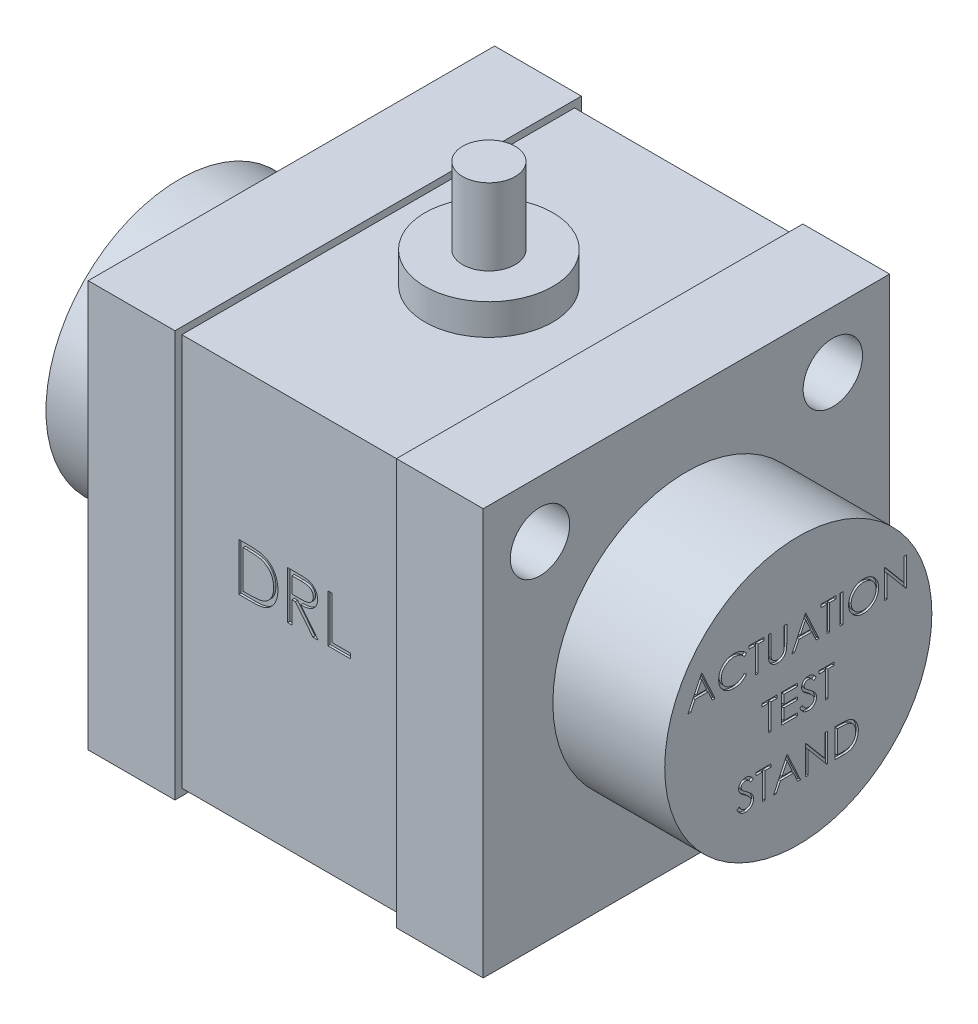
from build123d import *

# Parameters (mm, degrees)
SKETCH4_W           = 45.212
SKETCH4_H           = 45.212
SKETCH4_W_2         = 43.688
SKETCH4_H_2         = 43.688
BOSS_EXTRUDE1_DEPTH = 9.652
SKETCH4_3_W         = 43.688
SKETCH4_3_H         = 43.688
BOSS_EXTRUDE2_DEPTH = 24.638
BOSS_EXTRUDE3_START = 24.638
SKETCH4_4_W         = 45.212
SKETCH4_4_H         = 45.212
SKETCH4_4_W_2       = 43.688
SKETCH4_4_H_2       = 43.688
BOSS_EXTRUDE3_DEPTH = 9.652
BOSS_EXTRUDE4_DEPTH = 3.43789
BOSS_EXTRUDE5_START = 3.43789
BOSS_EXTRUDE5_DEPTH = 8.4963
SKETCH6_R           = 3.302
CUT_EXTRUDE1_DEPTH  = 60.857302977
SKETCH7_R           = 14.859
BOSS_EXTRUDE6_DEPTH = 12.446
BOSS_EXTRUDE7_START = -56.388
SKETCH7_2_R         = 14.859
BOSS_EXTRUDE7_DEPTH = 12.446
SKETCH8_W           = 0.284935898
SKETCH8_H           = 3.175
CUT_EXTRUDE2_DEPTH  = 0.254
SKETCH9_W           = 0.284935897
SKETCH9_H           = 3.175
CUT_EXTRUDE3_DEPTH  = 0.254
CUT_EXTRUDE4_DEPTH  = 0.254
CUT_EXTRUDE5_DEPTH  = 0.254


with BuildPart() as part:
    # Sketch4 → Boss-Extrude1 (new body)
    # profile 1 of 2: a face of its own
    with BuildSketch(Plane(origin=(0, 0, 0), x_dir=(0, 0, -1), z_dir=(1, 0, 0))):
        Rectangle(SKETCH4_W, SKETCH4_H)
        Rectangle(SKETCH4_W_2, SKETCH4_H_2, mode=Mode.SUBTRACT)
    # profile 2 of 2: a face of its own
    with BuildSketch(Plane(origin=(0, 0, 0), x_dir=(0, 0, -1), z_dir=(1, 0, 0))):
        Rectangle(SKETCH4_W_2, SKETCH4_H_2)
    extrude(amount=-BOSS_EXTRUDE1_DEPTH)

    # Sketch4<3> → Boss-Extrude2 (add)
    with BuildSketch(Plane(origin=(0, 0, 0), x_dir=(0, 0, -1), z_dir=(1, 0, 0))):
        Rectangle(SKETCH4_3_W, SKETCH4_3_H)
    extrude(amount=BOSS_EXTRUDE2_DEPTH)

    # Sketch4<4> → Boss-Extrude3 (add)
    # profile 1 of 2: a face of its own
    with BuildSketch(Plane(origin=(0, 0, 0), x_dir=(0, 0, -1), z_dir=(1, 0, 0)).offset(BOSS_EXTRUDE3_START)):
        Rectangle(SKETCH4_4_W, SKETCH4_4_H)
        Rectangle(SKETCH4_4_W_2, SKETCH4_4_H_2, mode=Mode.SUBTRACT)
    # profile 2 of 2: a face of its own
    with BuildSketch(Plane(origin=(0, 0, 0), x_dir=(0, 0, -1), z_dir=(1, 0, 0)).offset(BOSS_EXTRUDE3_START)):
        Rectangle(SKETCH4_4_W_2, SKETCH4_4_H_2)
    extrude(amount=BOSS_EXTRUDE3_DEPTH)

    # Sketch5 → Boss-Extrude4 (add)
    with BuildSketch(Plane(origin=(0, 21.844, 0), x_dir=(1, 0, 0), z_dir=(0, 1, 0))):
        with BuildLine():
            ThreePointArc((19.431, 0), (17.347943428, 5.028943428), (12.319, 7.112))
            Line((12.319, 7.112), (12.319, 2.921))
            ThreePointArc((12.319, 2.921), (14.384458908, 2.065458908), (15.24, 0))
            ThreePointArc((15.24, 0), (14.384458908, -2.065458908), (12.319, -2.921))
            Line((12.319, -2.921), (12.319, -7.112))
            ThreePointArc((12.319, -7.112), (17.347943428, -5.028943428), (19.431, 0))
        make_face()
        with BuildLine():
            Line((12.319, 2.921), (12.319, 7.112))
            ThreePointArc((12.319, 7.112), (5.207, 0), (12.319, -7.112))
            Line((12.319, -7.112), (12.319, -2.921))
            ThreePointArc((12.319, -2.921), (9.398, 0), (12.319, 2.921))
        make_face()
        with BuildLine():
            ThreePointArc((19.431, 0), (17.347943428, 5.028943428), (12.319, 7.112))
            Line((12.319, 7.112), (12.319, 2.921))
            ThreePointArc((12.319, 2.921), (14.384458908, 2.065458908), (15.24, 0))
            ThreePointArc((15.24, 0), (14.384458908, -2.065458908), (12.319, -2.921))
            Line((12.319, -2.921), (12.319, -7.112))
            ThreePointArc((12.319, -7.112), (17.347943428, -5.028943428), (19.431, 0))
        make_face()
        with BuildLine():
            Line((12.319, 2.921), (12.319, 7.112))
            ThreePointArc((12.319, 7.112), (5.207, 0), (12.319, -7.112))
            Line((12.319, -7.112), (12.319, -2.921))
            ThreePointArc((12.319, -2.921), (9.398, 0), (12.319, 2.921))
        make_face()
        with BuildLine():
            ThreePointArc((15.24, 0), (14.384458908, 2.065458908), (12.319, 2.921))
            Line((12.319, 2.921), (12.319, -2.921))
            ThreePointArc((12.319, -2.921), (14.384458908, -2.065458908), (15.24, 0))
        make_face()
        with BuildLine():
            Line((12.319, -2.921), (12.319, 2.921))
            ThreePointArc((12.319, 2.921), (9.398, 0), (12.319, -2.921))
        make_face()
        with BuildLine():
            ThreePointArc((15.24, 0), (14.384458908, 2.065458908), (12.319, 2.921))
            Line((12.319, 2.921), (12.319, -2.921))
            ThreePointArc((12.319, -2.921), (14.384458908, -2.065458908), (15.24, 0))
        make_face()
        with BuildLine():
            Line((12.319, -2.921), (12.319, 2.921))
            ThreePointArc((12.319, 2.921), (9.398, 0), (12.319, -2.921))
        make_face()
    extrude(amount=BOSS_EXTRUDE4_DEPTH)

    # Sketch5<3> → Boss-Extrude5 (add)
    with BuildSketch(Plane(origin=(0, 21.844, 0), x_dir=(1, 0, 0), z_dir=(0, 1, 0)).offset(BOSS_EXTRUDE5_START)):
        with BuildLine():
            ThreePointArc((15.24, 0), (14.384458908, 2.065458908), (12.319, 2.921))
            Line((12.319, 2.921), (12.319, -2.921))
            ThreePointArc((12.319, -2.921), (14.384458908, -2.065458908), (15.24, 0))
        make_face()
        with BuildLine():
            Line((12.319, -2.921), (12.319, 2.921))
            ThreePointArc((12.319, 2.921), (9.398, 0), (12.319, -2.921))
        make_face()
        with BuildLine():
            ThreePointArc((15.24, 0), (14.384458908, 2.065458908), (12.319, 2.921))
            Line((12.319, 2.921), (12.319, -2.921))
            ThreePointArc((12.319, -2.921), (14.384458908, -2.065458908), (15.24, 0))
        make_face()
        with BuildLine():
            Line((12.319, -2.921), (12.319, 2.921))
            ThreePointArc((12.319, 2.921), (9.398, 0), (12.319, -2.921))
        make_face()
    extrude(amount=BOSS_EXTRUDE5_DEPTH)

    # Sketch6 → Cut-Extrude1 (cut, through all)
    with BuildSketch(Plane(origin=(34.29, 0, 0), x_dir=(0, 0, -1), z_dir=(1, 0, 0))):
        with Locations((-16.28648, 16.28648)):
            Circle(SKETCH6_R)
        with Locations((16.28648, 16.28648)):
            Circle(SKETCH6_R)
    extrude(amount=-CUT_EXTRUDE1_DEPTH, mode=Mode.SUBTRACT)

    # Sketch7 → Boss-Extrude6 (add)
    with BuildSketch(Plane(origin=(34.29, 0, 0), x_dir=(0, 0, -1), z_dir=(1, 0, 0))):
        with Locations(Location((0, 0, 0), (0, 0, 180))):
            Circle(SKETCH7_R)
    extrude(amount=BOSS_EXTRUDE6_DEPTH)

    # Sketch7<2> → Boss-Extrude7 (add)
    with BuildSketch(Plane(origin=(34.29, 0, 0), x_dir=(0, 0, -1), z_dir=(1, 0, 0)).offset(BOSS_EXTRUDE7_START)):
        with Locations(Location((0, 0, 0), (0, 0, 180))):
            Circle(SKETCH7_2_R)
    extrude(amount=BOSS_EXTRUDE7_DEPTH)

    # Sketch8 → Cut-Extrude2 (cut)
    # profile 1 of 18: a face of its own
    with BuildSketch(Plane(origin=(46.736, 0, 0), x_dir=(0, 0, -1), z_dir=(1, 0, 0))):
        Polygon((-10.725801282, 7.057282112), (-9.260416667, 3.882282112), (-9.570157252, 3.882282112), (-10.039538261, 4.899910317), (-11.478846154, 4.899910317), (-11.960947516, 3.882282112), (-12.272596154, 3.882282112), (-10.76650641, 7.057282112), align=None)
        Polygon((-10.749333934, 6.437800942), (-11.323657853, 5.225551342), (-10.189638421, 5.225551342), align=None, mode=Mode.SUBTRACT)
    # profile 2 of 18: a face of its own
    with BuildSketch(Plane(origin=(46.736, 0, 0), x_dir=(0, 0, -1), z_dir=(1, 0, 0))):
        with BuildLine():
            Line((-5.759775641, 6.474689964), (-6.009094551, 6.283884676))
            add(Edge.make_bspline(
                [(-6.009094551, 6.283884676), (-6.026879893, 6.305080948), (-6.062210791, 6.347187722), (-6.119051639, 6.40631488), (-6.178289558, 6.461709796), (-6.239901904, 6.513636358), (-6.304997676, 6.56027871), (-6.371999972, 6.604067496), (-6.442029628, 6.643317515), (-6.538868701, 6.690908939), (-6.665549249, 6.740571522), (-6.825020282, 6.78221231), (-6.991491064, 6.808720091), (-7.105063172, 6.811591055), (-7.162830529, 6.813051342)],
                knots=[0, 0, 0, 0, 0.757959112, 1.505699292, 2.245454638, 2.979532153, 3.711538275, 4.438200793, 5.171680507, 5.909471876, 7.393775596, 8.890124382, 10.418191784, 12, 12, 12, 12], degree=3))
            add(Edge.make_bspline(
                [(-7.162830529, 6.813051342), (-7.194656093, 6.812684891), (-7.258011851, 6.811955388), (-7.352035823, 6.802331396), (-7.444304091, 6.788804798), (-7.534756635, 6.76873397), (-7.623278319, 6.743358808), (-7.710447855, 6.713037182), (-7.795003185, 6.675522435), (-7.878114016, 6.634058513), (-7.9577423, 6.587225046), (-8.033085093, 6.536140791), (-8.103867607, 6.481377396), (-8.170145834, 6.422729607), (-8.23198753, 6.360461543), (-8.28894459, 6.293909604), (-8.340819927, 6.223286561), (-8.388641799, 6.149523684), (-8.431470493, 6.07283583), (-8.467329741, 5.992939159), (-8.499084387, 5.911201866), (-8.524211558, 5.826700456), (-8.544100226, 5.740029518), (-8.557823178, 5.650956446), (-8.56733772, 5.559667322), (-8.568063595, 5.497791732), (-8.568429487, 5.466602023)],
                knots=[0, 0, 0, 0, 1.054917814, 2.100044995, 3.131103042, 4.146048494, 5.169673617, 6.183595914, 7.203665975, 8.234915748, 9.262203917, 10.264457458, 11.251630812, 12.227803204, 13.197192746, 14.159520551, 15.12972552, 16.100847026, 17.073214652, 18.039054194, 19.002613845, 19.979014051, 20.95965708, 21.949030935, 22.966165397, 24, 24, 24, 24], degree=3))
            add(Edge.make_bspline(
                [(-8.568429487, 5.466602023), (-8.567284837, 5.419674326), (-8.565037468, 5.327538017), (-8.54503648, 5.19258182), (-8.514642575, 5.063295209), (-8.469089873, 4.940486352), (-8.412920449, 4.822640913), (-8.341945037, 4.71175281), (-8.259742893, 4.606146355), (-8.165151098, 4.508317396), (-8.061368679, 4.418951373), (-7.950018788, 4.340256203), (-7.831378755, 4.274656274), (-7.706758526, 4.220068094), (-7.575199123, 4.178106634), (-7.436937124, 4.148566322), (-7.292273242, 4.129296629), (-7.19342243, 4.127451784), (-7.143113982, 4.126512881)],
                knots=[0, 0, 0, 0, 1.029171465, 2.020641659, 2.987623507, 3.938342917, 4.889210282, 5.84687017, 6.821220943, 7.821438502, 8.827599549, 9.822697543, 10.807740252, 11.797342354, 12.80366471, 13.83203677, 14.896651826, 16, 16, 16, 16], degree=3))
            add(Edge.make_bspline(
                [(-7.143113982, 4.126512881), (-7.087685114, 4.128044845), (-6.978587843, 4.131060118), (-6.818596848, 4.15660458), (-6.665438689, 4.198022834), (-6.519105128, 4.255987377), (-6.380008699, 4.33133946), (-6.247931729, 4.42268682), (-6.122762732, 4.530898379), (-6.047495926, 4.613523789), (-6.009094551, 4.655679548)],
                knots=[0, 0, 0, 0, 1.028121516, 2.023589091, 2.998037872, 3.967518031, 4.937445131, 5.927275754, 6.942489185, 8, 8, 8, 8], degree=3))
            Line((-6.009094551, 4.655679548), (-5.759775641, 4.466782312))
            add(Edge.make_bspline(
                [(-5.759775641, 4.466782312), (-5.779839926, 4.440893859), (-5.81987239, 4.389240958), (-5.88469502, 4.31642305), (-5.952982283, 4.247930103), (-6.025241391, 4.184314332), (-6.100641102, 4.124302781), (-6.180535271, 4.069600406), (-6.263873608, 4.019443675), (-6.350373742, 3.973517822), (-6.439943769, 3.932771462), (-6.532476364, 3.897888402), (-6.627572672, 3.867839395), (-6.72523704, 3.843117995), (-6.825672048, 3.823822083), (-6.928515264, 3.810922807), (-7.033988651, 3.802085499), (-7.105146226, 3.801280032), (-7.141205929, 3.800871855)],
                knots=[0, 0, 0, 0, 0.986787822, 1.968848986, 2.935600012, 3.899624008, 4.868462664, 5.837806735, 6.815139263, 7.798259679, 8.787526145, 9.778297419, 10.776456485, 11.791383307, 12.812564526, 13.85620153, 14.913611965, 16, 16, 16, 16], degree=3))
            add(Edge.make_bspline(
                [(-7.141205929, 3.800871855), (-7.175354113, 3.80110952), (-7.242877918, 3.801579472), (-7.342571785, 3.809192367), (-7.439626619, 3.819578914), (-7.53376503, 3.835218176), (-7.625500736, 3.853673399), (-7.714002123, 3.878412324), (-7.800140064, 3.906124783), (-7.883568487, 3.938695735), (-7.964358358, 3.9754497), (-8.042249101, 4.016989186), (-8.117204893, 4.062964877), (-8.189962668, 4.112363351), (-8.259447619, 4.166771332), (-8.326261888, 4.225433208), (-8.390780135, 4.28815126), (-8.430696856, 4.333376735), (-8.450766226, 4.356115245)],
                knots=[0, 0, 0, 0, 1.114604814, 2.203992996, 3.262667896, 4.300477797, 5.318619304, 6.316056647, 7.298880507, 8.271930387, 9.238335007, 10.195173496, 11.151986948, 12.108099108, 13.064862484, 14.031167946, 15.010108607, 16, 16, 16, 16], degree=3))
            add(Edge.make_bspline(
                [(-8.450766226, 4.356115245), (-8.482911417, 4.395613323), (-8.546813714, 4.474132625), (-8.628570584, 4.601392051), (-8.698554437, 4.73425964), (-8.755138308, 4.873433433), (-8.799373073, 5.018601134), (-8.830017443, 5.169835922), (-8.849930685, 5.326996555), (-8.852207875, 5.433891356), (-8.853365385, 5.488226623)],
                knots=[0, 0, 0, 0, 0.994628077, 1.977248131, 2.950237994, 3.925870899, 4.908910175, 5.911660606, 6.938484602, 8, 8, 8, 8], degree=3))
            add(Edge.make_bspline(
                [(-8.853365385, 5.488226623), (-8.851954602, 5.545336213), (-8.849178975, 5.657695766), (-8.825597075, 5.822590709), (-8.787661453, 5.980570907), (-8.733779989, 6.131341446), (-8.665467278, 6.275695344), (-8.581078849, 6.412529865), (-8.481595085, 6.542720105), (-8.36779622, 6.664290629), (-8.243002994, 6.775451328), (-8.109363784, 6.873246955), (-7.967140161, 6.954633559), (-7.817898967, 7.022665792), (-7.66052267, 7.074957555), (-7.495347043, 7.11156366), (-7.322682456, 7.134348473), (-7.204878684, 7.13722884), (-7.145022035, 7.138692368)],
                knots=[0, 0, 0, 0, 1.032925535, 2.032216505, 3.007276963, 3.968222605, 4.92396291, 5.891752235, 6.871517503, 7.883894988, 8.900124299, 9.891468569, 10.874487609, 11.85992873, 12.854644235, 13.869047385, 14.917252991, 16, 16, 16, 16], degree=3))
            add(Edge.make_bspline(
                [(-7.145022035, 7.138692368), (-7.108541764, 7.138255), (-7.036332742, 7.137389273), (-6.929514264, 7.128947273), (-6.825517296, 7.114874216), (-6.724270191, 7.095718924), (-6.625280389, 7.07194514), (-6.529304456, 7.040975012), (-6.435779219, 7.005563301), (-6.345294524, 6.96477955), (-6.25828451, 6.918999006), (-6.174776279, 6.868729119), (-6.095433157, 6.81403221), (-6.019696844, 6.755373472), (-5.948834281, 6.691511922), (-5.880833512, 6.624204103), (-5.818003819, 6.551511276), (-5.779220564, 6.500343944), (-5.759775641, 6.474689964)],
                knots=[0, 0, 0, 0, 1.096760587, 2.17092713, 3.219439832, 4.250915756, 5.268269357, 6.278326846, 7.281116186, 8.274029601, 9.260640565, 10.235837813, 11.203064059, 12.156899882, 13.114053108, 14.069676657, 15.032185724, 16, 16, 16, 16], degree=3))
        make_face()
    # profile 3 of 18: a face of its own
    with BuildSketch(Plane(origin=(46.736, 0, 0), x_dir=(0, 0, -1), z_dir=(1, 0, 0))):
        Polygon((-5.474839744, 6.731641086), (-5.474839744, 7.057282112), (-3.805929487, 7.057282112), (-3.805929487, 6.731641086), (-4.497916667, 6.731641086), (-4.497916667, 3.882282112), (-4.782852564, 3.882282112), (-4.782852564, 6.731641086), align=None)
    # profile 4 of 18: a face of its own
    with BuildSketch(Plane(origin=(46.736, 0, 0), x_dir=(0, 0, -1), z_dir=(1, 0, 0))):
        with BuildLine():
            Line((-3.317467949, 7.057282112), (-3.032532051, 7.057282112))
            Line((-3.032532051, 7.057282112), (-3.032532051, 5.154953386))
            add(Edge.make_bspline(
                [(-3.032532051, 5.154953386), (-3.032574455, 5.128028718), (-3.032654923, 5.076934522), (-3.032117428, 5.004210421), (-3.030612144, 4.939556119), (-3.029663128, 4.882722396), (-3.027551904, 4.833970047), (-3.025830104, 4.793034943), (-3.02361617, 4.760110917), (-3.020955414, 4.740896791), (-3.019811699, 4.732637681)],
                knots=[0, 0, 0, 0, 1.528628734, 2.90083645, 4.128790002, 5.200304208, 6.127813768, 6.898992206, 7.526736466, 8, 8, 8, 8], degree=3))
            add(Edge.make_bspline(
                [(-3.019811699, 4.732637681), (-3.015115004, 4.702840974), (-3.005986256, 4.644926498), (-2.982721328, 4.5624597), (-2.950229738, 4.488136162), (-2.911727835, 4.419636634), (-2.860988966, 4.358867715), (-2.800207187, 4.30288643), (-2.726567355, 4.253926292), (-2.644688091, 4.209158056), (-2.556436482, 4.17317616), (-2.466256262, 4.145967894), (-2.375502988, 4.12938632), (-2.314746039, 4.127466317), (-2.284575321, 4.126512881)],
                knots=[0, 0, 0, 0, 1.035780045, 2.013197591, 2.933192213, 3.817615948, 4.702609284, 5.640816605, 6.646850145, 7.73207398, 8.84249596, 9.914020372, 10.964143139, 12, 12, 12, 12], degree=3))
            add(Edge.make_bspline(
                [(-2.284575321, 4.126512881), (-2.258672999, 4.127487016), (-2.207017961, 4.129429661), (-2.130267841, 4.141459674), (-2.055519171, 4.163140901), (-1.98240284, 4.191116968), (-1.913867304, 4.228080854), (-1.849874325, 4.27078083), (-1.792757042, 4.320864982), (-1.740634429, 4.376291723), (-1.695245595, 4.43882997), (-1.655901773, 4.507117995), (-1.62367468, 4.582183474), (-1.607760197, 4.634937843), (-1.599584335, 4.662039724)],
                knots=[0, 0, 0, 0, 0.994687771, 1.983630487, 2.973142513, 3.978332533, 4.983357753, 5.956394766, 6.925816176, 7.893390482, 8.871859704, 9.88551698, 10.913711441, 12, 12, 12, 12], degree=3))
            add(Edge.make_bspline(
                [(-1.599584335, 4.662039724), (-1.596862793, 4.673241645), (-1.5907981, 4.698204039), (-1.585131138, 4.740405496), (-1.57922879, 4.79019799), (-1.57513343, 4.847939277), (-1.571140894, 4.913435874), (-1.568752321, 4.987028979), (-1.567648298, 5.068451365), (-1.567319295, 5.125272219), (-1.567147436, 5.154953386)],
                knots=[0, 0, 0, 0, 0.558680831, 1.244966039, 2.062412453, 2.990489873, 4.051219941, 5.244515665, 6.560634259, 8, 8, 8, 8], degree=3))
            Line((-1.567147436, 5.154953386), (-1.567147436, 7.057282112))
            Line((-1.567147436, 7.057282112), (-1.282211538, 7.057282112))
            Line((-1.282211538, 7.057282112), (-1.282211538, 5.139688963))
            add(Edge.make_bspline(
                [(-1.282211538, 5.139688963), (-1.282442062, 5.10512829), (-1.282891943, 5.037681037), (-1.28679318, 4.93884659), (-1.293013458, 4.845090671), (-1.301801938, 4.756400678), (-1.313446934, 4.673093976), (-1.326396598, 4.594440365), (-1.342888032, 4.521004436), (-1.36214976, 4.4522136), (-1.384169336, 4.386731027), (-1.412690949, 4.324583927), (-1.444826031, 4.263883007), (-1.482939323, 4.205546365), (-1.525766792, 4.149315706), (-1.574255102, 4.095532046), (-1.626800591, 4.043335911), (-1.684276763, 3.994066201), (-1.745736168, 3.948882615), (-1.810995987, 3.90915178), (-1.879554913, 3.87556607), (-1.951234735, 3.847920053), (-2.02606604, 3.827133238), (-2.104050717, 3.811643632), (-2.185366271, 3.802842262), (-2.240669923, 3.801534226), (-2.26867488, 3.800871855)],
                knots=[0, 0, 0, 0, 1.316592851, 2.569410997, 3.76748051, 4.895814652, 5.963796859, 6.97159953, 7.931736103, 8.829262218, 9.692595152, 10.560224239, 11.431080259, 12.30701507, 13.211635791, 14.121146779, 15.063487852, 16.031507147, 17.00238618, 17.966455255, 18.938106653, 19.907068911, 20.888905087, 21.893141452, 22.933117798, 24, 24, 24, 24], degree=3))
            add(Edge.make_bspline(
                [(-2.26867488, 3.800871855), (-2.299217566, 3.801583749), (-2.359142206, 3.802980483), (-2.447441739, 3.810983978), (-2.532091045, 3.826059236), (-2.613984162, 3.845254328), (-2.692006156, 3.871728146), (-2.767202352, 3.902660017), (-2.83828487, 3.940648674), (-2.90640688, 3.982915538), (-2.969747908, 4.030472174), (-3.02789341, 4.082306475), (-3.080939378, 4.137588103), (-3.127991696, 4.196915577), (-3.169829927, 4.259827483), (-3.205870906, 4.326501793), (-3.236816492, 4.396912695), (-3.252788163, 4.445855955), (-3.26086238, 4.470598418)],
                knots=[0, 0, 0, 0, 1.13879206, 2.234305948, 3.301075583, 4.341971843, 5.366689343, 6.369221514, 7.369726634, 8.367512178, 9.355451585, 10.318319045, 11.268648973, 12.207971039, 13.137398894, 14.081662264, 15.030215811, 16, 16, 16, 16], degree=3))
            add(Edge.make_bspline(
                [(-3.26086238, 4.470598418), (-3.265558802, 4.487500825), (-3.275745446, 4.524162521), (-3.286654109, 4.584838122), (-3.29582449, 4.654701654), (-3.304447389, 4.733757901), (-3.309535515, 4.822068137), (-3.313996335, 4.919594082), (-3.317499375, 5.026453662), (-3.317478717, 5.100888829), (-3.317467949, 5.139688963)],
                knots=[0, 0, 0, 0, 0.625038921, 1.35572334, 2.194682327, 3.136881307, 4.189498639, 5.346923369, 6.617055217, 8, 8, 8, 8], degree=3))
            Line((-3.317467949, 5.139688963), (-3.317467949, 7.057282112))
        make_face()
    # profile 5 of 18: a face of its own
    with BuildSketch(Plane(origin=(46.736, 0, 0), x_dir=(0, 0, -1), z_dir=(1, 0, 0))):
        Polygon((0.834455128, 7.057282112), (2.299839744, 3.882282112), (1.990099159, 3.882282112), (1.520718149, 4.899910317), (0.081410256, 4.899910317), (-0.400691106, 3.882282112), (-0.712339744, 3.882282112), (0.79375, 7.057282112), align=None)
        Polygon((0.810922476, 6.437800942), (0.236598558, 5.225551342), (1.370617989, 5.225551342), align=None, mode=Mode.SUBTRACT)
    # profile 6 of 18: a face of its own
    with BuildSketch(Plane(origin=(46.736, 0, 0), x_dir=(0, 0, -1), z_dir=(1, 0, 0))):
        Polygon((2.503365385, 6.731641086), (2.503365385, 7.057282112), (4.172275641, 7.057282112), (4.172275641, 6.731641086), (3.480288462, 6.731641086), (3.480288462, 3.882282112), (3.195352564, 3.882282112), (3.195352564, 6.731641086), align=None)
    # profile 7 of 18: a face of its own
    with BuildSketch(Plane(origin=(46.736, 0, 0), x_dir=(0, 0, -1), z_dir=(1, 0, 0))):
        with Locations((4.803205128, 5.469782112)):
            Rectangle(SKETCH8_W, SKETCH8_H)
    # profile 8 of 18: a face of its own
    with BuildSketch(Plane(origin=(46.736, 0, 0), x_dir=(0, 0, -1), z_dir=(1, 0, 0))):
        with BuildLine():
            add(Edge.make_bspline(
                [(7.245512821, 7.138692368), (7.304303031, 7.137203312), (7.419771854, 7.134278682), (7.589475512, 7.11189121), (7.751486777, 7.073160392), (7.907125403, 7.021577543), (8.054529746, 6.95276678), (8.194809312, 6.869595252), (8.327630334, 6.771191607), (8.451202587, 6.658316523), (8.564284249, 6.53550439), (8.663912017, 6.404442286), (8.747407527, 6.265922658), (8.815974633, 6.120361762), (8.869766944, 5.968088791), (8.906886362, 5.808291945), (8.930597398, 5.642006591), (8.933369425, 5.528589363), (8.934775641, 5.471054147)],
                knots=[0, 0, 0, 0, 1.065120563, 2.091984664, 3.0946048, 4.079830382, 5.057816894, 6.036188127, 7.030412546, 8.04752943, 9.064399622, 10.05169764, 11.02544977, 11.989514704, 12.962713494, 13.945757189, 14.957906945, 16, 16, 16, 16], degree=3))
            add(Edge.make_bspline(
                [(8.934775641, 5.471054147), (8.933369631, 5.413942749), (8.930598222, 5.301369568), (8.906859402, 5.136139443), (8.869629352, 4.977307169), (8.816474168, 4.825137898), (8.748233912, 4.679471108), (8.664182436, 4.540690086), (8.565175766, 4.408749333), (8.452502408, 4.285094273), (8.32967432, 4.17170371), (8.197929721, 4.07289873), (8.060231495, 3.98787756), (7.914807688, 3.920038084), (7.763586941, 3.865816414), (7.605215833, 3.828847956), (7.440436459, 3.805001853), (7.328067763, 3.802263628), (7.270953526, 3.800871855)],
                knots=[0, 0, 0, 0, 1.043624062, 2.057103931, 3.04512605, 4.022047818, 4.998200453, 5.980619268, 6.982898556, 8.009068085, 9.034988726, 10.034168286, 11.015286542, 11.987931943, 12.962482838, 13.94673481, 14.956375938, 16, 16, 16, 16], degree=3))
            add(Edge.make_bspline(
                [(7.270953526, 3.800871855), (7.213418608, 3.80227737), (7.100001969, 3.805048015), (6.933507658, 3.828798289), (6.773598562, 3.865937901), (6.620731972, 3.919014318), (6.474822643, 3.987609949), (6.335585211, 4.071252492), (6.203578556, 4.170500399), (6.079897114, 4.28313722), (5.96673177, 4.405757128), (5.86807148, 4.537142488), (5.784410127, 4.674715652), (5.716044818, 4.818858406), (5.66192063, 4.968873929), (5.624995545, 5.125762905), (5.601105074, 5.288630886), (5.598352035, 5.399522658), (5.596955128, 5.455789724)],
                knots=[0, 0, 0, 0, 1.053102029, 2.075944431, 3.073151272, 4.055350789, 5.033113405, 6.020478099, 7.024410459, 8.052272461, 9.079885166, 10.07527673, 11.055994387, 12.023226415, 12.992069828, 13.970394897, 14.97016774, 16, 16, 16, 16], degree=3))
            add(Edge.make_bspline(
                [(5.596955128, 5.455789724), (5.597440119, 5.493556502), (5.598403982, 5.568613614), (5.610007875, 5.680071173), (5.626845989, 5.78973627), (5.650977724, 5.897297058), (5.682538736, 6.002490237), (5.71977879, 6.106041286), (5.765262792, 6.206900807), (5.816680237, 6.305546598), (5.874067735, 6.400440913), (5.937455022, 6.49013882), (6.004615677, 6.57539301), (6.07824247, 6.653994221), (6.155908817, 6.728229038), (6.238874631, 6.796956645), (6.326633667, 6.860796779), (6.41956354, 6.918328089), (6.515374404, 6.970361018), (6.614141195, 7.015012269), (6.714522514, 7.053335482), (6.816988516, 7.084396802), (6.921267102, 7.10891872), (7.027585864, 7.125616819), (7.1358601, 7.137250308), (7.208804654, 7.138209613), (7.245512821, 7.138692368)],
                knots=[0, 0, 0, 0, 1.037015668, 2.060948919, 3.074880161, 4.083647147, 5.086022904, 6.090072063, 7.104153813, 8.122640571, 9.144368836, 10.147691507, 11.138137339, 12.123020368, 13.103399296, 14.087645067, 15.080126199, 16.082011238, 17.087798457, 18.072939717, 19.057185487, 20.037253025, 21.01195951, 21.997135196, 22.992090687, 24, 24, 24, 24], degree=3))
        make_face()
        with BuildLine():
            add(Edge.make_bspline(
                [(7.259505208, 6.813051342), (7.229374791, 6.812684049), (7.169402004, 6.811952974), (7.080243889, 6.802323003), (6.992258349, 6.788598033), (6.905427214, 6.76902051), (6.820113794, 6.742346834), (6.735522867, 6.711648296), (6.652425811, 6.674254878), (6.571096954, 6.632006782), (6.492252564, 6.585244546), (6.417855328, 6.533563015), (6.347712644, 6.478174183), (6.281996252, 6.418948788), (6.220899117, 6.355585221), (6.16321871, 6.289044082), (6.111267018, 6.217423438), (6.063655101, 6.142665426), (6.021048561, 6.06486742), (5.983161417, 5.984848474), (5.952169781, 5.901955858), (5.926894625, 5.817088872), (5.905939797, 5.730381927), (5.892664737, 5.641177264), (5.882928954, 5.549923127), (5.882239666, 5.488253873), (5.881891026, 5.457061759)],
                knots=[0, 0, 0, 0, 1.008559885, 2.007477868, 2.99961109, 3.989939068, 4.984837346, 5.991145699, 7.001802488, 8.033829008, 9.059044045, 10.069351652, 11.065060232, 12.050310815, 13.029377138, 14.011219647, 14.996725999, 15.989392538, 16.977580475, 17.965360261, 18.951710183, 19.937753436, 20.929683414, 21.935841486, 22.955955122, 24, 24, 24, 24], degree=3))
            add(Edge.make_bspline(
                [(5.881891026, 5.457061759), (5.883047508, 5.411194602), (5.885322665, 5.320959713), (5.905241318, 5.188727183), (5.935922681, 5.061647095), (5.981150435, 4.940414791), (6.037711349, 4.823988192), (6.107585743, 4.713400125), (6.19037077, 4.608620704), (6.284408398, 4.510381424), (6.387208282, 4.420714159), (6.496367258, 4.342007352), (6.610715888, 4.275413768), (6.730552365, 4.221162024), (6.855236918, 4.178172762), (6.985572982, 4.148710004), (7.120692327, 4.129319412), (7.212795136, 4.127457269), (7.259505208, 4.126512881)],
                knots=[0, 0, 0, 0, 1.032063989, 2.030389145, 3.003944642, 3.970395727, 4.937377036, 5.913328081, 6.909231446, 7.93887556, 8.970685674, 9.976071282, 10.964166581, 11.944589148, 12.933237628, 13.927779006, 14.949070134, 16, 16, 16, 16], degree=3))
            add(Edge.make_bspline(
                [(7.259505208, 4.126512881), (7.290900971, 4.126944231), (7.353168196, 4.127799729), (7.44578342, 4.136416385), (7.536730127, 4.150233867), (7.625880752, 4.170128105), (7.713134117, 4.195026642), (7.798854402, 4.224606509), (7.882128566, 4.261510173), (7.964007133, 4.302284386), (8.042380866, 4.348766529), (8.117197956, 4.398693993), (8.186572595, 4.454001242), (8.252239824, 4.512346686), (8.313587799, 4.574906748), (8.370201663, 4.641600092), (8.421890783, 4.712847688), (8.46948462, 4.787492307), (8.511941865, 4.865503193), (8.548934334, 4.945812258), (8.580317953, 5.02822175), (8.605653097, 5.112850533), (8.625506337, 5.199537874), (8.639185979, 5.288399845), (8.648754919, 5.379258677), (8.649476168, 5.440712032), (8.649839744, 5.471690165)],
                knots=[0, 0, 0, 0, 1.047197238, 2.076906641, 3.100256066, 4.114471768, 5.12198147, 6.126382909, 7.136867548, 8.15857795, 9.17633901, 10.174870724, 11.156907918, 12.133735059, 13.104061851, 14.077631395, 15.04955518, 16.038496417, 17.029181396, 18.010275684, 18.986308667, 19.968651475, 20.955262928, 21.950658345, 22.966943676, 24, 24, 24, 24], degree=3))
            add(Edge.make_bspline(
                [(8.649839744, 5.471690165), (8.649475877, 5.502456372), (8.64875408, 5.563486812), (8.639190549, 5.653711983), (8.625491885, 5.741934539), (8.60575, 5.827808132), (8.580304503, 5.911354651), (8.548928853, 5.992495629), (8.51193076, 6.071533349), (8.469469014, 6.148272461), (8.421738945, 6.221909545), (8.369583453, 6.292306019), (8.31210203, 6.358139863), (8.250936993, 6.421036335), (8.184560547, 6.479653992), (8.113273366, 6.534012279), (8.037940887, 6.585423035), (7.958178324, 6.631801223), (7.875860594, 6.674631277), (7.791392932, 6.711326116), (7.705732249, 6.742506538), (7.619096376, 6.769101214), (7.530756102, 6.788521355), (7.441308343, 6.802335372), (7.350876852, 6.811949622), (7.290059074, 6.812682937), (7.259505208, 6.813051342)],
                knots=[0, 0, 0, 0, 1.02996197, 2.043119294, 3.035359645, 4.018872909, 4.991431989, 5.957985074, 6.929999688, 7.912076566, 8.892894881, 9.867085534, 10.843653904, 11.817741046, 12.803660682, 13.806313499, 14.818574707, 15.856120519, 16.894564902, 17.924820532, 18.937903209, 19.946497019, 20.957711757, 21.963978472, 22.977135795, 24, 24, 24, 24], degree=3))
        make_face(mode=Mode.SUBTRACT)
    # profile 9 of 18: a face of its own
    with BuildSketch(Plane(origin=(46.736, 0, 0), x_dir=(0, 0, -1), z_dir=(1, 0, 0))):
        Polygon((9.586057692, 3.882282112), (9.586057692, 7.057282112), (9.645843349, 7.057282112), (11.743429487, 4.55836885), (11.743429487, 7.057282112), (12.028365385, 7.057282112), (12.028365385, 3.882282112), (11.963491587, 3.882282112), (9.87099359, 6.375471214), (9.87099359, 3.882282112), align=None)
    # profile 10 of 18: a face of its own
    with BuildSketch(Plane(origin=(46.736, 0, 0), x_dir=(0, 0, -1), z_dir=(1, 0, 0))):
        Polygon((-4.029807692, 0.439974419), (-4.029807692, 0.765615445), (-2.360897436, 0.765615445), (-2.360897436, 0.439974419), (-3.052884615, 0.439974419), (-3.052884615, -2.409384555), (-3.337820513, -2.409384555), (-3.337820513, 0.439974419), align=None)
    # profile 11 of 18: a face of its own
    with BuildSketch(Plane(origin=(46.736, 0, 0), x_dir=(0, 0, -1), z_dir=(1, 0, 0))):
        Polygon((-1.872435897, 0.765615445), (-0.081410256, 0.765615445), (-0.081410256, 0.439974419), (-1.5875, 0.439974419), (-1.5875, -0.536948658), (-0.081410256, -0.536948658), (-0.081410256, -0.862589683), (-1.5875, -0.862589683), (-1.5875, -2.083743529), (-0.081410256, -2.083743529), (-0.081410256, -2.409384555), (-1.872435897, -2.409384555), align=None)
    # profile 12 of 18: a face of its own
    with BuildSketch(Plane(origin=(46.736, 0, 0), x_dir=(0, 0, -1), z_dir=(1, 0, 0))):
        with BuildLine():
            Line((0.162820513, -1.796899579), (0.431219952, -1.635987119))
            add(Edge.make_bspline(
                [(0.431219952, -1.635987119), (0.456182924, -1.677774097), (0.504011016, -1.757836334), (0.583795463, -1.866020413), (0.666466033, -1.95797037), (0.752634928, -2.033151292), (0.841776181, -2.092341354), (0.934471715, -2.134253378), (1.030409158, -2.160393585), (1.095699696, -2.163568663), (1.128295272, -2.165153786)],
                knots=[0, 0, 0, 0, 1.272034388, 2.437168799, 3.508375237, 4.49857839, 5.41946034, 6.295179144, 7.148887113, 8, 8, 8, 8], degree=3))
            add(Edge.make_bspline(
                [(1.128295272, -2.165153786), (1.156132639, -2.164378476), (1.211320283, -2.162841422), (1.292566032, -2.148072408), (1.371470952, -2.125382834), (1.446408788, -2.092888132), (1.516345524, -2.053573934), (1.577674455, -2.006088473), (1.630693429, -1.952924273), (1.674063126, -1.893612864), (1.707337158, -1.829825165), (1.732911391, -1.764351267), (1.747103708, -1.696162637), (1.74924162, -1.650251717), (1.750320513, -1.627082872)],
                knots=[0, 0, 0, 0, 1.095163259, 2.171163733, 3.241058638, 4.321873601, 5.38011039, 6.391990106, 7.366004449, 8.327778327, 9.272591725, 10.192022065, 11.087607919, 12, 12, 12, 12], degree=3))
            add(Edge.make_bspline(
                [(1.750320513, -1.627082872), (1.748983102, -1.600647959), (1.746264342, -1.546909642), (1.723285071, -1.467625671), (1.687136112, -1.389164554), (1.653787142, -1.340631263), (1.636473357, -1.315434235)],
                knots=[0, 0, 0, 0, 0.938893495, 1.908633276, 2.914225137, 4, 4, 4, 4], degree=3))
            add(Edge.make_bspline(
                [(1.636473357, -1.315434235), (1.622257872, -1.297248902), (1.592414238, -1.25907107), (1.541108494, -1.202242892), (1.480904947, -1.143624755), (1.413863865, -1.080978325), (1.337543135, -1.017217252), (1.254333175, -0.949301029), (1.162109532, -0.879812455), (1.097430703, -0.833210199), (1.064057492, -0.809164202)],
                knots=[0, 0, 0, 0, 0.722233717, 1.516239348, 2.393582979, 3.351407094, 4.387010283, 5.505090956, 6.712668013, 8, 8, 8, 8], degree=3))
            add(Edge.make_bspline(
                [(1.064057492, -0.809164202), (1.030652867, -0.785371127), (0.966785767, -0.739880577), (0.877469768, -0.67236712), (0.797600862, -0.610641609), (0.72753404, -0.55412297), (0.66730012, -0.502803536), (0.616424454, -0.457176119), (0.576203049, -0.416006746), (0.553836915, -0.389299243), (0.543795072, -0.377308233)],
                knots=[0, 0, 0, 0, 1.452282411, 2.77665338, 3.964542531, 5.026858415, 5.96415736, 6.766646006, 7.446254459, 8, 8, 8, 8], degree=3))
            add(Edge.make_bspline(
                [(0.543795072, -0.377308233), (0.529759263, -0.35862015), (0.502155961, -0.321867525), (0.465719656, -0.264422833), (0.434750559, -0.205618871), (0.4104733, -0.145297622), (0.39002973, -0.084305937), (0.376279322, -0.021848021), (0.367669269, 0.041795869), (0.366787538, 0.084625258), (0.366346154, 0.106065165)],
                knots=[0, 0, 0, 0, 1.068054152, 2.10047183, 3.106115577, 4.101338837, 5.06977816, 6.043150881, 7.020423561, 8, 8, 8, 8], degree=3))
            add(Edge.make_bspline(
                [(0.366346154, 0.106065165), (0.367530165, 0.13965646), (0.369872879, 0.206121061), (0.389685349, 0.303213314), (0.420957188, 0.395910992), (0.464767551, 0.483296367), (0.521243864, 0.563094078), (0.586599855, 0.636222027), (0.664443131, 0.697697812), (0.749853011, 0.751411608), (0.843339863, 0.793453983), (0.94130304, 0.825168586), (1.043898241, 0.843138413), (1.113388227, 0.845717207), (1.148647837, 0.847025701)],
                knots=[0, 0, 0, 0, 1.005424448, 1.989358655, 2.955360095, 3.929531133, 4.905563448, 5.876582895, 6.856512386, 7.866279853, 8.892233794, 9.918561126, 10.94386622, 12, 12, 12, 12], degree=3))
            add(Edge.make_bspline(
                [(1.148647837, 0.847025701), (1.186062128, 0.845735244), (1.260467211, 0.843168936), (1.369913285, 0.820855461), (1.475287649, 0.783934137), (1.560054039, 0.742034426), (1.626395902, 0.700186642), (1.676989738, 0.662068658), (1.728259139, 0.618185524), (1.780617661, 0.568420351), (1.833178116, 0.512316512), (1.886720819, 0.450258245), (1.941370977, 0.382624797), (1.976528079, 0.334342572), (1.994551282, 0.309590806)],
                knots=[0, 0, 0, 0, 1.286793592, 2.559021753, 3.825965368, 5.121522368, 5.803751409, 6.523245864, 7.299691795, 8.125521123, 9.008227632, 9.944561021, 10.946284179, 12, 12, 12, 12], degree=3))
            Line((1.994551282, 0.309590806), (1.736964143, 0.114333394))
            add(Edge.make_bspline(
                [(1.736964143, 0.114333394), (1.721410332, 0.134370991), (1.691457331, 0.17295872), (1.645982725, 0.226998413), (1.603121451, 0.276361934), (1.560893589, 0.319238157), (1.521529366, 0.357975092), (1.483323192, 0.391140015), (1.446824887, 0.419057876), (1.400817404, 0.448851677), (1.343016331, 0.478385077), (1.27045893, 0.503376026), (1.194634238, 0.518393832), (1.142990929, 0.520379466), (1.116846955, 0.521384676)],
                knots=[0, 0, 0, 0, 1.181633172, 2.275549214, 3.290209073, 4.226197932, 5.078386478, 5.862611352, 6.581680152, 7.217281963, 8.414376989, 9.595101626, 10.782541182, 12, 12, 12, 12], degree=3))
            add(Edge.make_bspline(
                [(1.116846955, 0.521384676), (1.084047824, 0.520285491), (1.02079779, 0.518165816), (0.930999504, 0.495015544), (0.850178586, 0.458564856), (0.780734474, 0.407479126), (0.72291593, 0.346953654), (0.681091693, 0.277304264), (0.655918329, 0.200394513), (0.65284649, 0.146744582), (0.651282051, 0.119421535)],
                knots=[0, 0, 0, 0, 1.14458467, 2.207223713, 3.21896685, 4.227309161, 5.202851033, 6.127160689, 7.046193047, 8, 8, 8, 8], degree=3))
            add(Edge.make_bspline(
                [(0.651282051, 0.119421535), (0.651638673, 0.102411265), (0.6523525, 0.06836291), (0.66230821, 0.018060549), (0.675098315, -0.032114738), (0.695366274, -0.081937366), (0.723347371, -0.132278678), (0.760091352, -0.18400554), (0.806367714, -0.237573876), (0.841816146, -0.27241485), (0.860531851, -0.290809835)],
                knots=[0, 0, 0, 0, 0.858281714, 1.717966888, 2.583508476, 3.4729293, 4.427298488, 5.488583878, 6.674047936, 8, 8, 8, 8], degree=3))
            add(Edge.make_bspline(
                [(0.860531851, -0.290809835), (0.86748181, -0.297011995), (0.883993323, -0.311746905), (0.914179341, -0.335869902), (0.954041736, -0.365626703), (1.00253959, -0.402445197), (1.060567126, -0.445154809), (1.128130723, -0.493209443), (1.204477256, -0.54816911), (1.258653566, -0.58659345), (1.287299679, -0.606910597)],
                knots=[0, 0, 0, 0, 0.420754252, 0.999615792, 1.744751191, 2.668019286, 3.750313428, 4.999500688, 6.413464383, 8, 8, 8, 8], degree=3))
            add(Edge.make_bspline(
                [(1.287299679, -0.606910597), (1.321758329, -0.631985259), (1.388482729, -0.680538866), (1.483422105, -0.753487376), (1.569504345, -0.824832137), (1.64703168, -0.894117538), (1.716770018, -0.960818022), (1.777945665, -1.02573605), (1.831181961, -1.088406534), (1.888494538, -1.168754513), (1.947057702, -1.267434497), (1.99735107, -1.388336899), (2.029063285, -1.509709276), (2.033210303, -1.591285763), (2.03525641, -1.631534996)],
                knots=[0, 0, 0, 0, 1.163667725, 2.253281268, 3.268753668, 4.215851969, 5.092017293, 5.902905408, 6.650798638, 7.335211899, 8.59617414, 9.77448103, 10.901945474, 12, 12, 12, 12], degree=3))
            add(Edge.make_bspline(
                [(2.03525641, -1.631534996), (2.034660292, -1.659999656), (2.033479632, -1.716376211), (2.019907946, -1.799157602), (2.000023678, -1.879558462), (1.970054187, -1.956584971), (1.933475322, -2.031646292), (1.887060226, -2.102773459), (1.833259684, -2.171540692), (1.77154334, -2.236114287), (1.704010271, -2.295392622), (1.63263292, -2.348123985), (1.557294458, -2.392091678), (1.478403585, -2.427969942), (1.395942179, -2.456031062), (1.309937975, -2.476362736), (1.220249204, -2.488841131), (1.159288768, -2.490136314), (1.128295272, -2.490794811)],
                knots=[0, 0, 0, 0, 0.983748083, 1.948392443, 2.894712957, 3.844097841, 4.80183111, 5.778335162, 6.776009319, 7.81870978, 8.863265674, 9.881300176, 10.883814829, 11.87499822, 12.874611388, 13.892143829, 14.928324115, 16, 16, 16, 16], degree=3))
            add(Edge.make_bspline(
                [(1.128295272, -2.490794811), (1.10431464, -2.490331097), (1.056655386, -2.489409507), (0.986161785, -2.481262203), (0.9170923, -2.469735045), (0.85031363, -2.451434281), (0.784965407, -2.429230166), (0.721331844, -2.401890393), (0.659382102, -2.369126932), (0.598769009, -2.331666445), (0.539646722, -2.288071205), (0.482569776, -2.237295248), (0.425665444, -2.180738968), (0.370613306, -2.116866529), (0.31629981, -2.046709839), (0.263795825, -1.969612509), (0.212014552, -1.885994481), (0.179524806, -1.827152581), (0.162820513, -1.796899579)],
                knots=[0, 0, 0, 0, 0.915332311, 1.819136955, 2.706846663, 3.586547465, 4.459518054, 5.340707479, 6.227863349, 7.133153174, 8.059268498, 9.028702269, 10.047606654, 11.120612155, 12.245963614, 13.433783089, 14.680604001, 16, 16, 16, 16], degree=3))
        make_face()
    # profile 13 of 18: a face of its own
    with BuildSketch(Plane(origin=(46.736, 0, 0), x_dir=(0, 0, -1), z_dir=(1, 0, 0))):
        Polygon((2.320192308, 0.439974419), (2.320192308, 0.765615445), (3.989102564, 0.765615445), (3.989102564, 0.439974419), (3.297115385, 0.439974419), (3.297115385, -2.409384555), (3.012179487, -2.409384555), (3.012179487, 0.439974419), align=None)
    # profile 14 of 18: a face of its own
    with BuildSketch(Plane(origin=(46.736, 0, 0), x_dir=(0, 0, -1), z_dir=(1, 0, 0))):
        with BuildLine():
            Line((-6.838461538, -8.088566246), (-6.570062099, -7.927653786))
            add(Edge.make_bspline(
                [(-6.570062099, -7.927653786), (-6.545099127, -7.969440764), (-6.497271035, -8.049503), (-6.417486588, -8.15768708), (-6.334816019, -8.249637036), (-6.248647123, -8.324817959), (-6.15950587, -8.384008021), (-6.066810336, -8.425920045), (-5.970872893, -8.452060251), (-5.905582355, -8.45523533), (-5.872986779, -8.456820452)],
                knots=[0, 0, 0, 0, 1.272034388, 2.437168799, 3.508375237, 4.49857839, 5.41946034, 6.295179144, 7.148887113, 8, 8, 8, 8], degree=3))
            add(Edge.make_bspline(
                [(-5.872986779, -8.456820452), (-5.845149413, -8.456045142), (-5.789961768, -8.454508088), (-5.708716019, -8.439739075), (-5.629811099, -8.417049501), (-5.554873263, -8.384554799), (-5.484936527, -8.345240601), (-5.423607596, -8.29775514), (-5.370588622, -8.244590939), (-5.327218925, -8.185279531), (-5.293944893, -8.121491832), (-5.26837066, -8.056017933), (-5.254178343, -7.987829303), (-5.252040431, -7.941918384), (-5.250961538, -7.918749539)],
                knots=[0, 0, 0, 0, 1.095163259, 2.171163733, 3.241058638, 4.321873601, 5.38011039, 6.391990106, 7.366004449, 8.327778327, 9.272591725, 10.192022065, 11.087607919, 12, 12, 12, 12], degree=3))
            add(Edge.make_bspline(
                [(-5.250961538, -7.918749539), (-5.252298949, -7.892314625), (-5.255017709, -7.838576309), (-5.27799698, -7.759292338), (-5.31414594, -7.680831221), (-5.347494909, -7.63229793), (-5.364808694, -7.607100901)],
                knots=[0, 0, 0, 0, 0.938893495, 1.908633276, 2.914225137, 4, 4, 4, 4], degree=3))
            add(Edge.make_bspline(
                [(-5.364808694, -7.607100901), (-5.37902418, -7.588915568), (-5.408867814, -7.550737737), (-5.460173557, -7.493909559), (-5.520377104, -7.435291422), (-5.587418186, -7.372644991), (-5.663738916, -7.308883919), (-5.746948876, -7.240967695), (-5.839172519, -7.171479122), (-5.903851348, -7.124876866), (-5.937224559, -7.100830869)],
                knots=[0, 0, 0, 0, 0.722233717, 1.516239348, 2.393582979, 3.351407094, 4.387010283, 5.505090956, 6.712668013, 8, 8, 8, 8], degree=3))
            add(Edge.make_bspline(
                [(-5.937224559, -7.100830869), (-5.970629184, -7.077037793), (-6.034496284, -7.031547244), (-6.123812284, -6.964033786), (-6.203681189, -6.902308276), (-6.273748011, -6.845789636), (-6.333981931, -6.794470202), (-6.384857597, -6.748842786), (-6.425079002, -6.707673413), (-6.447445136, -6.68096591), (-6.457486979, -6.6689749)],
                knots=[0, 0, 0, 0, 1.452282411, 2.77665338, 3.964542531, 5.026858415, 5.96415736, 6.766646006, 7.446254459, 8, 8, 8, 8], degree=3))
            add(Edge.make_bspline(
                [(-6.457486979, -6.6689749), (-6.471522788, -6.650286816), (-6.49912609, -6.613534192), (-6.535562395, -6.5560895), (-6.566531493, -6.497285537), (-6.590808751, -6.436964289), (-6.611252321, -6.375972603), (-6.62500273, -6.313514688), (-6.633612782, -6.249870798), (-6.634494513, -6.207041408), (-6.634935897, -6.185601502)],
                knots=[0, 0, 0, 0, 1.068054152, 2.10047183, 3.106115577, 4.101338837, 5.06977816, 6.043150881, 7.020423561, 8, 8, 8, 8], degree=3))
            add(Edge.make_bspline(
                [(-6.634935897, -6.185601502), (-6.633751886, -6.152010207), (-6.631409172, -6.085545606), (-6.611596703, -5.988453353), (-6.580324863, -5.895755674), (-6.536514501, -5.8083703), (-6.480038188, -5.728572589), (-6.414682197, -5.65544464), (-6.33683892, -5.593968855), (-6.25142904, -5.540255059), (-6.157942188, -5.498212684), (-6.059979012, -5.46649808), (-5.957383811, -5.448528254), (-5.887893824, -5.44594946), (-5.852634215, -5.444640965)],
                knots=[0, 0, 0, 0, 1.005424448, 1.989358655, 2.955360095, 3.929531133, 4.905563448, 5.876582895, 6.856512386, 7.866279853, 8.892233794, 9.918561126, 10.94386622, 12, 12, 12, 12], degree=3))
            add(Edge.make_bspline(
                [(-5.852634215, -5.444640965), (-5.815219924, -5.445931423), (-5.74081484, -5.448497731), (-5.631368766, -5.470811206), (-5.525994402, -5.50773253), (-5.441228012, -5.549632241), (-5.37488615, -5.591480025), (-5.324292314, -5.629598008), (-5.273022912, -5.673481143), (-5.220664391, -5.723246316), (-5.168103935, -5.779350154), (-5.114561232, -5.841408422), (-5.059911074, -5.909041869), (-5.024753972, -5.957324095), (-5.006730769, -5.982075861)],
                knots=[0, 0, 0, 0, 1.286793592, 2.559021753, 3.825965368, 5.121522368, 5.803751409, 6.523245864, 7.299691795, 8.125521123, 9.008227632, 9.944561021, 10.946284179, 12, 12, 12, 12], degree=3))
            Line((-5.006730769, -5.982075861), (-5.264317909, -6.177333273))
            add(Edge.make_bspline(
                [(-5.264317909, -6.177333273), (-5.279871719, -6.157295675), (-5.309824721, -6.118707947), (-5.355299327, -6.064668254), (-5.3981606, -6.015304733), (-5.440388463, -5.97242851), (-5.479752685, -5.933691574), (-5.51795886, -5.900526652), (-5.554457164, -5.87260879), (-5.600464647, -5.84281499), (-5.65826572, -5.81328159), (-5.730823121, -5.788290641), (-5.806647813, -5.773272834), (-5.858291122, -5.771287201), (-5.884435096, -5.770281991)],
                knots=[0, 0, 0, 0, 1.181633172, 2.275549214, 3.290209073, 4.226197932, 5.078386478, 5.862611352, 6.581680152, 7.217281963, 8.414376989, 9.595101626, 10.782541182, 12, 12, 12, 12], degree=3))
            add(Edge.make_bspline(
                [(-5.884435096, -5.770281991), (-5.917234227, -5.771381176), (-5.980484262, -5.773500851), (-6.070282547, -5.796651123), (-6.151103465, -5.83310181), (-6.220547578, -5.884187541), (-6.278366121, -5.944713013), (-6.320190359, -6.014362403), (-6.345363722, -6.091272153), (-6.348435562, -6.144922085), (-6.35, -6.172245132)],
                knots=[0, 0, 0, 0, 1.14458467, 2.207223713, 3.21896685, 4.227309161, 5.202851033, 6.127160689, 7.046193047, 8, 8, 8, 8], degree=3))
            add(Edge.make_bspline(
                [(-6.35, -6.172245132), (-6.349643378, -6.189255402), (-6.348929551, -6.223303757), (-6.338973841, -6.273606118), (-6.326183736, -6.323781404), (-6.305915777, -6.373604033), (-6.27793468, -6.423945345), (-6.241190699, -6.475672206), (-6.194914338, -6.529240542), (-6.159465905, -6.564081517), (-6.1407502, -6.582476502)],
                knots=[0, 0, 0, 0, 0.858281714, 1.717966888, 2.583508476, 3.4729293, 4.427298488, 5.488583878, 6.674047936, 8, 8, 8, 8], degree=3))
            add(Edge.make_bspline(
                [(-6.1407502, -6.582476502), (-6.133800241, -6.588678661), (-6.117288729, -6.603413572), (-6.08710271, -6.627536569), (-6.047240315, -6.65729337), (-5.998742461, -6.694111864), (-5.940714926, -6.736821476), (-5.873151328, -6.78487611), (-5.796804795, -6.839835776), (-5.742628486, -6.878260117), (-5.713982372, -6.898577263)],
                knots=[0, 0, 0, 0, 0.420754252, 0.999615792, 1.744751191, 2.668019286, 3.750313428, 4.999500688, 6.413464383, 8, 8, 8, 8], degree=3))
            add(Edge.make_bspline(
                [(-5.713982372, -6.898577263), (-5.679523722, -6.923651925), (-5.612799322, -6.972205533), (-5.517859946, -7.045154042), (-5.431777706, -7.116498804), (-5.354250371, -7.185784205), (-5.284512033, -7.252484689), (-5.223336386, -7.317402717), (-5.17010009, -7.380073201), (-5.112787514, -7.46042118), (-5.054224349, -7.559101164), (-5.003930981, -7.680003566), (-4.972218766, -7.801375942), (-4.968071749, -7.88295243), (-4.966025641, -7.923201662)],
                knots=[0, 0, 0, 0, 1.163667725, 2.253281268, 3.268753668, 4.215851969, 5.092017293, 5.902905408, 6.650798638, 7.335211899, 8.59617414, 9.77448103, 10.901945474, 12, 12, 12, 12], degree=3))
            add(Edge.make_bspline(
                [(-4.966025641, -7.923201662), (-4.966621759, -7.951666322), (-4.967802419, -8.008042877), (-4.981374105, -8.090824268), (-5.001258373, -8.171225129), (-5.031227864, -8.248251638), (-5.067806729, -8.323312958), (-5.114221825, -8.394440125), (-5.168022368, -8.463207358), (-5.229738712, -8.527780954), (-5.29727178, -8.587059289), (-5.368649132, -8.639790652), (-5.443987594, -8.683758345), (-5.522878467, -8.719636609), (-5.605339872, -8.747697728), (-5.691344076, -8.768029403), (-5.781032847, -8.780507797), (-5.841993284, -8.781802981), (-5.872986779, -8.782461478)],
                knots=[0, 0, 0, 0, 0.983748083, 1.948392443, 2.894712957, 3.844097841, 4.80183111, 5.778335162, 6.776009319, 7.81870978, 8.863265674, 9.881300176, 10.883814829, 11.87499822, 12.874611388, 13.892143829, 14.928324115, 16, 16, 16, 16], degree=3))
            add(Edge.make_bspline(
                [(-5.872986779, -8.782461478), (-5.896967411, -8.781997763), (-5.944626665, -8.781076174), (-6.015120267, -8.77292887), (-6.084189751, -8.761401711), (-6.150968421, -8.743100948), (-6.216316645, -8.720896833), (-6.279950207, -8.69355706), (-6.341899949, -8.660793598), (-6.402513042, -8.623333112), (-6.461635329, -8.579737872), (-6.518712275, -8.528961915), (-6.575616608, -8.472405635), (-6.630668746, -8.408533195), (-6.684982241, -8.338376506), (-6.737486227, -8.261279175), (-6.789267499, -8.177661147), (-6.821757245, -8.118819248), (-6.838461538, -8.088566246)],
                knots=[0, 0, 0, 0, 0.915332311, 1.819136955, 2.706846663, 3.586547465, 4.459518054, 5.340707479, 6.227863349, 7.133153174, 8.059268498, 9.028702269, 10.047606654, 11.120612155, 12.245963614, 13.433783089, 14.680604001, 16, 16, 16, 16], degree=3))
        make_face()
    # profile 15 of 18: a face of its own
    with BuildSketch(Plane(origin=(46.736, 0, 0), x_dir=(0, 0, -1), z_dir=(1, 0, 0))):
        Polygon((-4.681089744, -5.851692247), (-4.681089744, -5.526051222), (-3.012179487, -5.526051222), (-3.012179487, -5.851692247), (-3.704166667, -5.851692247), (-3.704166667, -8.701051222), (-3.989102564, -8.701051222), (-3.989102564, -5.851692247), align=None)
    # profile 16 of 18: a face of its own
    with BuildSketch(Plane(origin=(46.736, 0, 0), x_dir=(0, 0, -1), z_dir=(1, 0, 0))):
        Polygon((-1.221153846, -5.526051222), (0.244230769, -8.701051222), (-0.065509816, -8.701051222), (-0.534890825, -7.683423017), (-1.974198718, -7.683423017), (-2.45630008, -8.701051222), (-2.767948718, -8.701051222), (-1.261858974, -5.526051222), align=None)
        Polygon((-1.244686498, -6.145532392), (-1.819010417, -7.357781991), (-0.684990986, -7.357781991), align=None, mode=Mode.SUBTRACT)
    # profile 17 of 18: a face of its own
    with BuildSketch(Plane(origin=(46.736, 0, 0), x_dir=(0, 0, -1), z_dir=(1, 0, 0))):
        Polygon((0.814102564, -8.701051222), (0.814102564, -5.526051222), (0.873888221, -5.526051222), (2.971474359, -8.024964483), (2.971474359, -5.526051222), (3.256410256, -5.526051222), (3.256410256, -8.701051222), (3.191536458, -8.701051222), (1.099038462, -6.207862119), (1.099038462, -8.701051222), align=None)
    # profile 18 of 18: a face of its own
    with BuildSketch(Plane(origin=(46.736, 0, 0), x_dir=(0, 0, -1), z_dir=(1, 0, 0))):
        with BuildLine():
            Line((4.070512821, -8.701051222), (4.070512821, -5.526051222))
            Line((4.070512821, -5.526051222), (4.71161859, -5.526051222))
            add(Edge.make_bspline(
                [(4.71161859, -5.526051222), (4.767379743, -5.526452696), (4.875110002, -5.527228342), (5.030787008, -5.532146318), (5.174826564, -5.540846241), (5.306754943, -5.553518597), (5.426934328, -5.569078849), (5.535028208, -5.588582787), (5.631595509, -5.611613484), (5.690985645, -5.631249), (5.719070513, -5.640534395)],
                knots=[0, 0, 0, 0, 1.314313732, 2.53924729, 3.670748893, 4.714932338, 5.66265055, 6.526160246, 7.303039223, 8, 8, 8, 8], degree=3))
            add(Edge.make_bspline(
                [(5.719070513, -5.640534395), (5.755805026, -5.654532249), (5.828441036, -5.682210533), (5.931861783, -5.734422321), (6.02922122, -5.79357992), (6.121041444, -5.85976131), (6.205225051, -5.934840397), (6.285060786, -6.015627897), (6.357282714, -6.105061605), (6.423420954, -6.201286773), (6.483052588, -6.303169849), (6.534885967, -6.410516697), (6.577933518, -6.522782165), (6.613668802, -6.639654049), (6.641832374, -6.761389335), (6.661047412, -6.88812977), (6.673721096, -7.019374463), (6.674994771, -7.108432727), (6.675641026, -7.153620332)],
                knots=[0, 0, 0, 0, 0.984719456, 1.947108742, 2.898477687, 3.838006223, 4.779231079, 5.722358779, 6.681677486, 7.655904652, 8.64651281, 9.637519902, 10.640069247, 11.656948941, 12.698408672, 13.768548281, 14.867775369, 16, 16, 16, 16], degree=3))
            add(Edge.make_bspline(
                [(6.675641026, -7.153620332), (6.675070462, -7.192864456), (6.673946108, -7.2701991), (6.663850228, -7.384173341), (6.649175995, -7.494766366), (6.62645733, -7.601451537), (6.598877907, -7.705163563), (6.563531855, -7.804797099), (6.523041084, -7.901266126), (6.475824408, -7.993266265), (6.423989009, -8.08042761), (6.368361428, -8.162592554), (6.309000997, -8.238588648), (6.245341673, -8.308646031), (6.178206101, -8.372659092), (6.107154744, -8.431162563), (6.032004263, -8.483011723), (5.95309125, -8.530244029), (5.868113618, -8.57144678), (5.775461797, -8.606308289), (5.674740657, -8.635197718), (5.566197425, -8.659301317), (5.449644555, -8.678421441), (5.324967779, -8.691236097), (5.192358652, -8.699901972), (5.101300319, -8.7006607), (5.054432091, -8.701051222)],
                knots=[0, 0, 0, 0, 1.105936401, 2.179363191, 3.223086493, 4.248585256, 5.251745608, 6.245858792, 7.225916811, 8.198733463, 9.158002045, 10.082870192, 10.993790845, 11.873723703, 12.748670949, 13.606408763, 14.465103618, 15.319838547, 16.196477973, 17.123216899, 18.106603292, 19.147568657, 20.255746949, 21.433717677, 22.679120308, 24, 24, 24, 24], degree=3))
            Line((5.054432091, -8.701051222), (4.070512821, -8.701051222))
        make_face()
        with BuildLine():
            Line((4.355448718, -8.375410196), (4.719886819, -8.375410196))
            add(Edge.make_bspline(
                [(4.719886819, -8.375410196), (4.772254698, -8.375185137), (4.872977308, -8.374752267), (5.01780992, -8.370953875), (5.150143372, -8.36474726), (5.269996456, -8.356061297), (5.377301499, -8.344569053), (5.472282758, -8.331755749), (5.554628885, -8.315792347), (5.604457732, -8.301322548), (5.627483974, -8.294635957)],
                knots=[0, 0, 0, 0, 1.375205317, 2.645023457, 3.804390687, 4.853969522, 5.800190428, 6.637939096, 7.370582563, 8, 8, 8, 8], degree=3))
            add(Edge.make_bspline(
                [(5.627483974, -8.294635957), (5.656465703, -8.284429187), (5.713736932, -8.264259434), (5.796179059, -8.227467841), (5.87306577, -8.183886821), (5.945737008, -8.135443329), (6.013161902, -8.080428742), (6.076139493, -8.020039345), (6.134542985, -7.953967799), (6.187768964, -7.882296109), (6.235401497, -7.805470366), (6.276650398, -7.724245853), (6.31280143, -7.639512532), (6.341175582, -7.549969224), (6.363414719, -7.456416435), (6.379166972, -7.358847585), (6.388977472, -7.257280893), (6.390121785, -7.188200038), (6.390705128, -7.152984315)],
                knots=[0, 0, 0, 0, 0.998632004, 1.973411704, 2.929992603, 3.868527914, 4.809262121, 5.754881198, 6.702106254, 7.672490631, 8.653608572, 9.636854334, 10.631411391, 11.644891563, 12.686317036, 13.754757253, 14.855430412, 16, 16, 16, 16], degree=3))
            add(Edge.make_bspline(
                [(6.390705128, -7.152984315), (6.390239503, -7.1158518), (6.389324779, -7.042904647), (6.377827369, -6.935870231), (6.361025672, -6.832927069), (6.336729042, -6.734068278), (6.305767459, -6.639100987), (6.267128034, -6.548550431), (6.222980458, -6.4614603), (6.17045386, -6.379840697), (6.112926857, -6.302649091), (6.049084067, -6.231932846), (5.979939789, -6.167530874), (5.906248176, -6.108440212), (5.825932378, -6.057038163), (5.740884388, -6.011058102), (5.649856529, -5.972036543), (5.58652644, -5.951282146), (5.554341947, -5.940734715)],
                knots=[0, 0, 0, 0, 1.122418816, 2.205001699, 3.251619955, 4.274784885, 5.280384055, 6.268708349, 7.249350384, 8.229342522, 9.199999885, 10.157847722, 11.105861043, 12.055065948, 13.010012805, 13.98527497, 14.976112212, 16, 16, 16, 16], degree=3))
            add(Edge.make_bspline(
                [(5.554341947, -5.940734715), (5.527716264, -5.933371956), (5.471102757, -5.917716709), (5.378719815, -5.900639407), (5.274747501, -5.885576754), (5.158724201, -5.872824104), (5.03078217, -5.863673462), (4.89082301, -5.856805198), (4.738786226, -5.852172753), (4.63339207, -5.851856426), (4.578690905, -5.851692247)],
                knots=[0, 0, 0, 0, 0.674548936, 1.434276114, 2.292660221, 3.240891867, 4.284742987, 5.42552168, 6.663806718, 8, 8, 8, 8], degree=3))
            Line((4.578690905, -5.851692247), (4.355448718, -5.851692247))
            Line((4.355448718, -5.851692247), (4.355448718, -8.375410196))
        make_face(mode=Mode.SUBTRACT)
    extrude(amount=-CUT_EXTRUDE2_DEPTH, mode=Mode.SUBTRACT)

    # Sketch9 → Cut-Extrude3 (cut)
    # profile 1 of 10: a face of its own
    with BuildSketch(Plane.ZY.offset(22.098)):
        with Locations((-4.823557692, 6.999736542)):
            Rectangle(SKETCH9_W, SKETCH9_H)
    # profile 2 of 10: a face of its own
    with BuildSketch(Plane.ZY.offset(22.098)):
        Polygon((-2.564423077, 8.587236542), (-1.099038462, 5.412236542), (-1.408779046, 5.412236542), (-1.878160056, 6.429864747), (-3.317467949, 6.429864747), (-3.799569311, 5.412236542), (-4.111217949, 5.412236542), (-2.605128205, 8.587236542), align=None)
        Polygon((-2.587955729, 7.967755372), (-3.162279647, 6.755505773), (-2.028260216, 6.755505773), align=None, mode=Mode.SUBTRACT)
    # profile 3 of 10: a face of its own
    with BuildSketch(Plane.ZY.offset(22.098)):
        Polygon((-0.529166667, 5.412236542), (-0.529166667, 8.587236542), (-0.46938101, 8.587236542), (1.628205128, 6.088323281), (1.628205128, 8.587236542), (1.913141026, 8.587236542), (1.913141026, 5.412236542), (1.848267228, 5.412236542), (-0.244230769, 7.905425645), (-0.244230769, 5.412236542), align=None)
    # profile 4 of 10: a face of its own
    with BuildSketch(Plane.ZY.offset(22.098)):
        Polygon((2.80483774, 7.691723721), (2.607036258, 7.691723721), (2.564423077, 8.668646798), (2.849358974, 8.668646798), align=None)
    # profile 5 of 10: a face of its own
    with BuildSketch(Plane.ZY.offset(22.098)):
        with BuildLine():
            Line((3.256410256, 6.024721518), (3.524809696, 6.185633978))
            add(Edge.make_bspline(
                [(3.524809696, 6.185633978), (3.549772668, 6.143847), (3.59760076, 6.063784763), (3.677385207, 5.955600684), (3.760055776, 5.863650727), (3.846224672, 5.788469805), (3.935365925, 5.729279743), (4.028061459, 5.687367719), (4.123998902, 5.661227512), (4.18928944, 5.658052434), (4.221885016, 5.656467311)],
                knots=[0, 0, 0, 0, 1.272034388, 2.437168799, 3.508375237, 4.49857839, 5.41946034, 6.295179144, 7.148887113, 8, 8, 8, 8], degree=3))
            add(Edge.make_bspline(
                [(4.221885016, 5.656467311), (4.249722382, 5.657242621), (4.304910026, 5.658779675), (4.386155775, 5.673548689), (4.465060696, 5.696238263), (4.539998532, 5.728732965), (4.609935268, 5.768047163), (4.671264199, 5.815532624), (4.724283173, 5.868696825), (4.767652869, 5.928008233), (4.800926901, 5.991795932), (4.826501135, 6.05726983), (4.840693452, 6.12545846), (4.842831364, 6.17136938), (4.843910256, 6.194538225)],
                knots=[0, 0, 0, 0, 1.095163259, 2.171163733, 3.241058638, 4.321873601, 5.38011039, 6.391990106, 7.366004449, 8.327778327, 9.272591725, 10.192022065, 11.087607919, 12, 12, 12, 12], degree=3))
            add(Edge.make_bspline(
                [(4.843910256, 6.194538225), (4.842572846, 6.220973138), (4.839854086, 6.274711455), (4.816874815, 6.353995426), (4.780725855, 6.432456543), (4.747376886, 6.480989834), (4.730063101, 6.506186863)],
                knots=[0, 0, 0, 0, 0.938893495, 1.908633276, 2.914225137, 4, 4, 4, 4], degree=3))
            add(Edge.make_bspline(
                [(4.730063101, 6.506186863), (4.715847615, 6.524372195), (4.686003981, 6.562550027), (4.634698238, 6.619378205), (4.574494691, 6.677996342), (4.507453609, 6.740642772), (4.431132878, 6.804403845), (4.347922919, 6.872320069), (4.255699275, 6.941808642), (4.191020446, 6.988410898), (4.157647236, 7.012456895)],
                knots=[0, 0, 0, 0, 0.722233717, 1.516239348, 2.393582979, 3.351407094, 4.387010283, 5.505090956, 6.712668013, 8, 8, 8, 8], degree=3))
            add(Edge.make_bspline(
                [(4.157647236, 7.012456895), (4.12424261, 7.03624997), (4.060375511, 7.08174052), (3.971059511, 7.149253977), (3.891190606, 7.210979488), (3.821123783, 7.267498127), (3.760889863, 7.318817562), (3.710014198, 7.364444978), (3.669792792, 7.405614351), (3.647426658, 7.432321854), (3.637384816, 7.444312864)],
                knots=[0, 0, 0, 0, 1.452282411, 2.77665338, 3.964542531, 5.026858415, 5.96415736, 6.766646006, 7.446254459, 8, 8, 8, 8], degree=3))
            add(Edge.make_bspline(
                [(3.637384816, 7.444312864), (3.623349007, 7.463000948), (3.595745705, 7.499753572), (3.5593094, 7.557198264), (3.528340302, 7.616002226), (3.504063044, 7.676323475), (3.483619474, 7.73731516), (3.469869065, 7.799773076), (3.461259012, 7.863416966), (3.460377282, 7.906246356), (3.459935897, 7.927686262)],
                knots=[0, 0, 0, 0, 1.068054152, 2.10047183, 3.106115577, 4.101338837, 5.06977816, 6.043150881, 7.020423561, 8, 8, 8, 8], degree=3))
            add(Edge.make_bspline(
                [(3.459935897, 7.927686262), (3.461119908, 7.961277557), (3.463462623, 8.027742158), (3.483275092, 8.124834411), (3.514546932, 8.21753209), (3.558357294, 8.304917464), (3.614833607, 8.384715175), (3.680189598, 8.457843124), (3.758032875, 8.519318909), (3.843442755, 8.573032705), (3.936929606, 8.61507508), (4.034892783, 8.646789683), (4.137487984, 8.66475951), (4.206977971, 8.667338304), (4.24223758, 8.668646798)],
                knots=[0, 0, 0, 0, 1.005424448, 1.989358655, 2.955360095, 3.929531133, 4.905563448, 5.876582895, 6.856512386, 7.866279853, 8.892233794, 9.918561126, 10.94386622, 12, 12, 12, 12], degree=3))
            add(Edge.make_bspline(
                [(4.24223758, 8.668646798), (4.279651871, 8.667356341), (4.354056954, 8.664790033), (4.463503029, 8.642476558), (4.568877393, 8.605555234), (4.653643783, 8.563655523), (4.719985645, 8.521807739), (4.770579481, 8.483689755), (4.821848883, 8.439806621), (4.874207404, 8.390041448), (4.92676786, 8.333937609), (4.980310563, 8.271879342), (5.034960721, 8.204245894), (5.070117822, 8.155963669), (5.088141026, 8.131211903)],
                knots=[0, 0, 0, 0, 1.286793592, 2.559021753, 3.825965368, 5.121522368, 5.803751409, 6.523245864, 7.299691795, 8.125521123, 9.008227632, 9.944561021, 10.946284179, 12, 12, 12, 12], degree=3))
            Line((5.088141026, 8.131211903), (4.830553886, 7.935954491))
            add(Edge.make_bspline(
                [(4.830553886, 7.935954491), (4.815000076, 7.955992088), (4.785047074, 7.994579817), (4.739572468, 8.04861951), (4.696711195, 8.097983031), (4.654483332, 8.140859254), (4.615119109, 8.179596189), (4.576912935, 8.212761112), (4.540414631, 8.240678973), (4.494407148, 8.270472774), (4.436606075, 8.300006174), (4.364048674, 8.324997123), (4.288223982, 8.340014929), (4.236580673, 8.342000563), (4.210436699, 8.343005773)],
                knots=[0, 0, 0, 0, 1.181633172, 2.275549214, 3.290209073, 4.226197932, 5.078386478, 5.862611352, 6.581680152, 7.217281963, 8.414376989, 9.595101626, 10.782541182, 12, 12, 12, 12], degree=3))
            add(Edge.make_bspline(
                [(4.210436699, 8.343005773), (4.177637568, 8.341906588), (4.114387533, 8.339786913), (4.024589248, 8.316636641), (3.94376833, 8.280185953), (3.874324217, 8.229100223), (3.816505674, 8.168574751), (3.774681436, 8.098925361), (3.749508073, 8.02201561), (3.746436233, 7.968365679), (3.744871795, 7.941042632)],
                knots=[0, 0, 0, 0, 1.14458467, 2.207223713, 3.21896685, 4.227309161, 5.202851033, 6.127160689, 7.046193047, 8, 8, 8, 8], degree=3))
            add(Edge.make_bspline(
                [(3.744871795, 7.941042632), (3.745228417, 7.924032362), (3.745942244, 7.889984007), (3.755897953, 7.839681646), (3.768688059, 7.789506359), (3.788956018, 7.739683731), (3.816937115, 7.689342419), (3.853681096, 7.637615557), (3.899957457, 7.584047222), (3.93540589, 7.549206247), (3.954121595, 7.530811262)],
                knots=[0, 0, 0, 0, 0.858281714, 1.717966888, 2.583508476, 3.4729293, 4.427298488, 5.488583878, 6.674047936, 8, 8, 8, 8], degree=3))
            add(Edge.make_bspline(
                [(3.954121595, 7.530811262), (3.961071554, 7.524609102), (3.977583066, 7.509874192), (4.007769084, 7.485751195), (4.04763148, 7.455994394), (4.096129334, 7.4191759), (4.154156869, 7.376466288), (4.221720467, 7.328411654), (4.298067, 7.273451987), (4.352243309, 7.235027647), (4.380889423, 7.2147105)],
                knots=[0, 0, 0, 0, 0.420754252, 0.999615792, 1.744751191, 2.668019286, 3.750313428, 4.999500688, 6.413464383, 8, 8, 8, 8], degree=3))
            add(Edge.make_bspline(
                [(4.380889423, 7.2147105), (4.415348073, 7.189635838), (4.482072473, 7.141082231), (4.577011849, 7.068133721), (4.663094089, 6.99678896), (4.740621424, 6.927503559), (4.810359762, 6.860803075), (4.871535409, 6.795885047), (4.924771704, 6.733214563), (4.982084281, 6.652866584), (5.040647446, 6.5541866), (5.090940813, 6.433284198), (5.122653029, 6.311911821), (5.126800046, 6.230335334), (5.128846154, 6.190086101)],
                knots=[0, 0, 0, 0, 1.163667725, 2.253281268, 3.268753668, 4.215851969, 5.092017293, 5.902905408, 6.650798638, 7.335211899, 8.59617414, 9.77448103, 10.901945474, 12, 12, 12, 12], degree=3))
            add(Edge.make_bspline(
                [(5.128846154, 6.190086101), (5.128250036, 6.161621442), (5.127069376, 6.105244886), (5.11349769, 6.022463495), (5.093613422, 5.942062635), (5.063643931, 5.865036126), (5.027065066, 5.789974805), (4.98064997, 5.718847639), (4.926849427, 5.650080406), (4.865133083, 5.58550681), (4.797600015, 5.526228475), (4.726222663, 5.473497112), (4.650884201, 5.429529419), (4.571993328, 5.393651155), (4.489531923, 5.365590035), (4.403527719, 5.345258361), (4.313838948, 5.332779966), (4.252878511, 5.331484783), (4.221885016, 5.330826286)],
                knots=[0, 0, 0, 0, 0.983748083, 1.948392443, 2.894712957, 3.844097841, 4.80183111, 5.778335162, 6.776009319, 7.81870978, 8.863265674, 9.881300176, 10.883814829, 11.87499822, 12.874611388, 13.892143829, 14.928324115, 16, 16, 16, 16], degree=3))
            add(Edge.make_bspline(
                [(4.221885016, 5.330826286), (4.197904383, 5.33129), (4.15024513, 5.33221159), (4.079751528, 5.340358894), (4.010682044, 5.351886052), (3.943903374, 5.370186816), (3.87855515, 5.392390931), (3.814921588, 5.419730704), (3.752971846, 5.452494165), (3.692358753, 5.489954652), (3.633236466, 5.533549892), (3.57615952, 5.584325849), (3.519255187, 5.640882129), (3.464203049, 5.704754568), (3.409889554, 5.774911258), (3.357385568, 5.852008588), (3.305604296, 5.935626616), (3.27311455, 5.994468516), (3.256410256, 6.024721518)],
                knots=[0, 0, 0, 0, 0.915332311, 1.819136955, 2.706846663, 3.586547465, 4.459518054, 5.340707479, 6.227863349, 7.133153174, 8.059268498, 9.028702269, 10.047606654, 11.120612155, 12.245963614, 13.433783089, 14.680604001, 16, 16, 16, 16], degree=3))
        make_face()
    # profile 6 of 10: a face of its own
    with BuildSketch(Plane.ZY.offset(22.098)):
        Polygon((-0.569871795, 2.295569875), (0.895512821, -0.879430125), (0.585772236, -0.879430125), (0.116391226, 0.13819808), (-1.322916667, 0.13819808), (-1.805018029, -0.879430125), (-2.116666667, -0.879430125), (-0.610576923, 2.295569875), align=None)
        Polygon((-0.593404447, 1.676088705), (-1.167728365, 0.463839106), (-0.033708934, 0.463839106), align=None, mode=Mode.SUBTRACT)
    # profile 7 of 10: a face of its own
    with BuildSketch(Plane.ZY.offset(22.098)):
        Polygon((-5.373076923, -7.171096791), (-5.373076923, -3.996096791), (-5.313291266, -3.996096791), (-3.215705128, -6.495010053), (-3.215705128, -3.996096791), (-2.930769231, -3.996096791), (-2.930769231, -7.171096791), (-2.995643029, -7.171096791), (-5.088141026, -4.677907689), (-5.088141026, -7.171096791), align=None)
    # profile 8 of 10: a face of its own
    with BuildSketch(Plane.ZY.offset(22.098)):
        Polygon((-2.116666667, -3.996096791), (-0.325641026, -3.996096791), (-0.325641026, -4.321737817), (-1.831730769, -4.321737817), (-1.831730769, -5.298660894), (-0.325641026, -5.298660894), (-0.325641026, -5.62430192), (-1.831730769, -5.62430192), (-1.831730769, -6.845455766), (-0.325641026, -6.845455766), (-0.325641026, -7.171096791), (-2.116666667, -7.171096791), align=None)
    # profile 9 of 10: a face of its own
    with BuildSketch(Plane.ZY.offset(22.098)):
        with BuildLine():
            Line((0.244230769, -3.996096791), (0.87961238, -3.996096791))
            add(Edge.make_bspline(
                [(0.87961238, -3.996096791), (0.922013261, -3.99623793), (1.003427649, -3.996508932), (1.120061973, -3.998020017), (1.226040839, -4.00235104), (1.321308836, -4.006078112), (1.405864216, -4.012874373), (1.479966258, -4.019370103), (1.54327367, -4.027873352), (1.581596692, -4.035770414), (1.598948317, -4.03934599)],
                knots=[0, 0, 0, 0, 1.410062039, 2.707475311, 3.878576406, 4.937260626, 5.877586885, 6.699081471, 7.410979367, 8, 8, 8, 8], degree=3))
            add(Edge.make_bspline(
                [(1.598948317, -4.03934599), (1.622177183, -4.04508527), (1.668139381, -4.056441396), (1.734315512, -4.080444034), (1.797374935, -4.108220407), (1.857055704, -4.140844639), (1.913058886, -4.178558904), (1.965961925, -4.220712129), (2.016004881, -4.267073666), (2.061163931, -4.318812415), (2.103744357, -4.373092677), (2.139656897, -4.431788228), (2.170614489, -4.493166899), (2.195262029, -4.557852914), (2.215108477, -4.62521895), (2.22910228, -4.695875216), (2.237494428, -4.769499814), (2.238348826, -4.819717346), (2.238782051, -4.845180325)],
                knots=[0, 0, 0, 0, 1.027469482, 2.033020251, 3.019912614, 3.986113645, 4.951240523, 5.91722682, 6.890402269, 7.87763091, 8.8651537, 9.85103654, 10.82876324, 11.815024772, 12.821070561, 13.842952187, 14.906261191, 16, 16, 16, 16], degree=3))
            add(Edge.make_bspline(
                [(2.238782051, -4.845180325), (2.23744946, -4.887485027), (2.23484923, -4.970032458), (2.210605743, -5.089830543), (2.170894186, -5.20158085), (2.116172345, -5.305142672), (2.046486106, -5.398497328), (1.962734331, -5.480494384), (1.864870298, -5.549110591), (1.773766561, -5.596692778), (1.693290109, -5.627166345), (1.627038461, -5.648607899), (1.554769131, -5.66517411), (1.477174549, -5.680015087), (1.393931805, -5.691219838), (1.305240412, -5.699426392), (1.211037117, -5.704555422), (1.14632239, -5.705319241), (1.113030849, -5.705712176)],
                knots=[0, 0, 0, 0, 1.260483769, 2.459530307, 3.627416485, 4.787058657, 5.939039949, 7.08810263, 8.267026773, 9.491475466, 10.141966685, 10.831826277, 11.566392101, 12.351337768, 13.187381173, 14.07005841, 15.007169909, 16, 16, 16, 16], degree=3))
            Line((1.113030849, -5.705712176), (2.279487179, -7.171096791))
            Line((2.279487179, -7.171096791), (1.927133413, -7.171096791))
            Line((1.927133413, -7.171096791), (0.760677083, -5.705712176))
            Line((0.760677083, -5.705712176), (0.529166667, -5.705712176))
            Line((0.529166667, -5.705712176), (0.529166667, -7.171096791))
            Line((0.529166667, -7.171096791), (0.244230769, -7.171096791))
            Line((0.244230769, -7.171096791), (0.244230769, -3.996096791))
        make_face()
        with BuildLine():
            Line((0.529166667, -4.321737817), (0.529166667, -5.38007115))
            Line((0.529166667, -5.38007115), (1.110486779, -5.384523274))
            add(Edge.make_bspline(
                [(1.110486779, -5.384523274), (1.137628528, -5.384535281), (1.19023697, -5.384558555), (1.266346858, -5.38093563), (1.33721296, -5.376814191), (1.402564213, -5.370510142), (1.462429814, -5.362385705), (1.516779839, -5.352222998), (1.565703007, -5.340382913), (1.622760967, -5.322057152), (1.686475535, -5.293023121), (1.755719073, -5.250781562), (1.81468548, -5.197651004), (1.864503826, -5.136896511), (1.904535525, -5.070097914), (1.932758603, -4.998055922), (1.950667818, -4.922589258), (1.952780142, -4.870720546), (1.953846154, -4.844544307)],
                knots=[0, 0, 0, 0, 1.146690395, 2.22261258, 3.21895312, 4.145990853, 4.996080663, 5.770904154, 6.481378293, 7.121626537, 8.300444488, 9.431385265, 10.535395872, 11.636531494, 12.74115979, 13.810798291, 14.895190096, 16, 16, 16, 16], degree=3))
            add(Edge.make_bspline(
                [(1.953846154, -4.844544307), (1.952755658, -4.819011344), (1.950594694, -4.768414328), (1.932951883, -4.694340752), (1.903116515, -4.624430018), (1.862909914, -4.558966521), (1.813924966, -4.499543461), (1.756486664, -4.448700686), (1.692165523, -4.406745815), (1.632048079, -4.37993577), (1.578314186, -4.363498474), (1.531660137, -4.351931347), (1.478944725, -4.34263815), (1.419911988, -4.335192266), (1.354813937, -4.328792424), (1.283321418, -4.324481882), (1.205908767, -4.321929305), (1.152254051, -4.321803132), (1.124479167, -4.321737817)],
                knots=[0, 0, 0, 0, 1.101028733, 2.181837193, 3.264309656, 4.369019818, 5.486613113, 6.575447106, 7.666700264, 8.788928104, 9.402425223, 10.0903467, 10.862060571, 11.710948788, 12.657782767, 13.684531032, 14.801375019, 16, 16, 16, 16], degree=3))
            Line((1.124479167, -4.321737817), (0.529166667, -4.321737817))
        make_face(mode=Mode.SUBTRACT)
    # profile 10 of 10: a face of its own
    with BuildSketch(Plane.ZY.offset(22.098)):
        with BuildLine():
            Line((2.930769231, -7.171096791), (2.930769231, -3.996096791))
            Line((2.930769231, -3.996096791), (3.571875, -3.996096791))
            add(Edge.make_bspline(
                [(3.571875, -3.996096791), (3.627636154, -3.996498266), (3.735366412, -3.997273912), (3.891043418, -4.002191888), (4.035082974, -4.01089181), (4.167011353, -4.023564166), (4.287190738, -4.039124418), (4.395284619, -4.058628356), (4.49185192, -4.081659054), (4.551242055, -4.101294569), (4.579326923, -4.110579964)],
                knots=[0, 0, 0, 0, 1.314313732, 2.53924729, 3.670748893, 4.714932338, 5.66265055, 6.526160246, 7.303039223, 8, 8, 8, 8], degree=3))
            add(Edge.make_bspline(
                [(4.579326923, -4.110579964), (4.616061437, -4.124577819), (4.688697447, -4.152256103), (4.792118194, -4.20446789), (4.88947763, -4.26362549), (4.981297854, -4.32980688), (5.065481461, -4.404885967), (5.145317196, -4.485673466), (5.217539124, -4.575107175), (5.283677364, -4.671332342), (5.343308998, -4.773215418), (5.395142377, -4.880562267), (5.438189928, -4.992827734), (5.473925212, -5.109699619), (5.502088784, -5.231434904), (5.521303822, -5.35817534), (5.533977506, -5.489420033), (5.535251181, -5.578478297), (5.535897436, -5.623665902)],
                knots=[0, 0, 0, 0, 0.984719456, 1.947108742, 2.898477687, 3.838006223, 4.779231079, 5.722358779, 6.681677486, 7.655904652, 8.64651281, 9.637519902, 10.640069247, 11.656948941, 12.698408672, 13.768548281, 14.867775369, 16, 16, 16, 16], degree=3))
            add(Edge.make_bspline(
                [(5.535897436, -5.623665902), (5.535326873, -5.662910025), (5.534202518, -5.74024467), (5.524106638, -5.854218911), (5.509432405, -5.964811936), (5.48671374, -6.071497107), (5.459134317, -6.175209133), (5.423788266, -6.274842669), (5.383297494, -6.371311696), (5.336080819, -6.463311835), (5.284245419, -6.55047318), (5.228617838, -6.632638123), (5.169257407, -6.708634217), (5.105598083, -6.778691601), (5.038462512, -6.842704661), (4.967411155, -6.901208133), (4.892260673, -6.953057293), (4.81334766, -7.000289598), (4.728370029, -7.041492349), (4.635718207, -7.076353858), (4.534997067, -7.105243288), (4.426453835, -7.129346886), (4.309900966, -7.148467011), (4.18522419, -7.161281667), (4.052615062, -7.169947541), (3.961556729, -7.17070627), (3.914688502, -7.171096791)],
                knots=[0, 0, 0, 0, 1.105936401, 2.179363191, 3.223086493, 4.248585256, 5.251745608, 6.245858792, 7.225916811, 8.198733463, 9.158002045, 10.082870192, 10.993790845, 11.873723703, 12.748670949, 13.606408763, 14.465103618, 15.319838547, 16.196477973, 17.123216899, 18.106603292, 19.147568657, 20.255746949, 21.433717677, 22.679120308, 24, 24, 24, 24], degree=3))
            Line((3.914688502, -7.171096791), (2.930769231, -7.171096791))
        make_face()
        with BuildLine():
            Line((3.215705128, -6.845455766), (3.580143229, -6.845455766))
            add(Edge.make_bspline(
                [(3.580143229, -6.845455766), (3.632511108, -6.845230707), (3.733233718, -6.844797836), (3.87806633, -6.840999445), (4.010399783, -6.83479283), (4.130252866, -6.826106867), (4.23755791, -6.814614623), (4.332539168, -6.801801318), (4.414885296, -6.785837916), (4.464714142, -6.771368118), (4.487740385, -6.764681527)],
                knots=[0, 0, 0, 0, 1.375205317, 2.645023457, 3.804390687, 4.853969522, 5.800190428, 6.637939096, 7.370582563, 8, 8, 8, 8], degree=3))
            add(Edge.make_bspline(
                [(4.487740385, -6.764681527), (4.516722113, -6.754474756), (4.573993342, -6.734305003), (4.656435469, -6.697513411), (4.733322181, -6.65393239), (4.805993418, -6.605488899), (4.873418312, -6.550474311), (4.936395904, -6.490084914), (4.994799395, -6.424013368), (5.048025374, -6.352341679), (5.095657907, -6.275515936), (5.136906808, -6.194291422), (5.17305784, -6.109558102), (5.201431992, -6.020014793), (5.223671129, -5.926462005), (5.239423382, -5.828893154), (5.249233882, -5.727326463), (5.250378196, -5.658245607), (5.250961538, -5.623029884)],
                knots=[0, 0, 0, 0, 0.998632004, 1.973411704, 2.929992603, 3.868527914, 4.809262121, 5.754881198, 6.702106254, 7.672490631, 8.653608572, 9.636854334, 10.631411391, 11.644891563, 12.686317036, 13.754757253, 14.855430412, 16, 16, 16, 16], degree=3))
            add(Edge.make_bspline(
                [(5.250961538, -5.623029884), (5.250495913, -5.58589737), (5.249581189, -5.512950217), (5.238083779, -5.405915801), (5.221282082, -5.302972639), (5.196985453, -5.204113848), (5.16602387, -5.109146557), (5.127384445, -5.018596001), (5.083236869, -4.93150587), (5.03071027, -4.849886267), (4.973183268, -4.772694661), (4.909340477, -4.701978416), (4.840196199, -4.637576443), (4.766504586, -4.578485781), (4.686188789, -4.527083732), (4.601140798, -4.481103672), (4.510112939, -4.442082113), (4.446782851, -4.421327716), (4.414598357, -4.410780285)],
                knots=[0, 0, 0, 0, 1.122418816, 2.205001699, 3.251619955, 4.274784885, 5.280384055, 6.268708349, 7.249350384, 8.229342522, 9.199999885, 10.157847722, 11.105861043, 12.055065948, 13.010012805, 13.98527497, 14.976112212, 16, 16, 16, 16], degree=3))
            add(Edge.make_bspline(
                [(4.414598357, -4.410780285), (4.387972675, -4.403417525), (4.331359168, -4.387762278), (4.238976225, -4.370684976), (4.135003911, -4.355622323), (4.018980611, -4.342869674), (3.89103858, -4.333719032), (3.75107942, -4.326850768), (3.599042636, -4.322218323), (3.49364848, -4.321901996), (3.438947316, -4.321737817)],
                knots=[0, 0, 0, 0, 0.674548936, 1.434276114, 2.292660221, 3.240891867, 4.284742987, 5.42552168, 6.663806718, 8, 8, 8, 8], degree=3))
            Line((3.438947316, -4.321737817), (3.215705128, -4.321737817))
            Line((3.215705128, -4.321737817), (3.215705128, -6.845455766))
        make_face(mode=Mode.SUBTRACT)
    extrude(amount=-CUT_EXTRUDE3_DEPTH, mode=Mode.SUBTRACT)

    # Sketch10 → Cut-Extrude4 (cut)
    # profile 1 of 3: a face of its own
    with BuildSketch(Plane.XY.offset(21.844)):
        with BuildLine():
            Line((6.34891453, 0), (6.34891453, 5.291666667))
            Line((6.34891453, 5.291666667), (7.417424145, 5.291666667))
            add(Edge.make_bspline(
                [(7.417424145, 5.291666667), (7.510359401, 5.290997543), (7.689909832, 5.2897048), (7.949371509, 5.281508172), (8.189437435, 5.267008301), (8.409318067, 5.245887708), (8.609617043, 5.219953955), (8.78977351, 5.187447391), (8.950719012, 5.149062896), (9.04970257, 5.116337036), (9.096510684, 5.100861378)],
                knots=[0, 0, 0, 0, 1.314313732, 2.53924729, 3.670748893, 4.714932338, 5.66265055, 6.526160246, 7.303039223, 8, 8, 8, 8], degree=3))
            add(Edge.make_bspline(
                [(9.096510684, 5.100861378), (9.157734873, 5.077531621), (9.27879489, 5.031401148), (9.451162801, 4.944381502), (9.613428529, 4.845785503), (9.766462236, 4.735483186), (9.906768247, 4.610351374), (10.039827805, 4.475705542), (10.160197685, 4.326649361), (10.270428085, 4.166274081), (10.369814142, 3.996468955), (10.456203107, 3.81755754), (10.527949025, 3.630448428), (10.587507832, 3.435661955), (10.634447119, 3.232769812), (10.666472183, 3.021535753), (10.687594989, 2.802794597), (10.68971778, 2.654364158), (10.690794872, 2.579051482)],
                knots=[0, 0, 0, 0, 0.984719456, 1.947108742, 2.898477687, 3.838006223, 4.779231079, 5.722358779, 6.681677486, 7.655904652, 8.64651281, 9.637519902, 10.640069247, 11.656948941, 12.698408672, 13.768548281, 14.867775369, 16, 16, 16, 16], degree=3))
            add(Edge.make_bspline(
                [(10.690794872, 2.579051482), (10.689843933, 2.51364461), (10.687970008, 2.384753536), (10.671143543, 2.194796468), (10.646686487, 2.010474759), (10.608822045, 1.832666141), (10.562856341, 1.659812764), (10.503946255, 1.493756871), (10.436461636, 1.332975159), (10.357767176, 1.179641594), (10.271374844, 1.034372686), (10.178662209, 0.897431114), (10.079728157, 0.770770957), (9.973629284, 0.65400865), (9.861736665, 0.547320216), (9.743317736, 0.449814431), (9.618066933, 0.363399164), (9.486545245, 0.284678655), (9.34491586, 0.216007403), (9.190496157, 0.157904888), (9.02262759, 0.109755839), (8.841722203, 0.069583175), (8.647467421, 0.037716301), (8.439672795, 0.016358541), (8.218657583, 0.001915416), (8.066893694, 0.000650869), (7.988779981, 0)],
                knots=[0, 0, 0, 0, 1.105936401, 2.179363191, 3.223086493, 4.248585256, 5.251745608, 6.245858792, 7.225916811, 8.198733463, 9.158002045, 10.082870192, 10.993790845, 11.873723703, 12.748670949, 13.606408763, 14.465103618, 15.319838547, 16.196477973, 17.123216899, 18.106603292, 19.147568657, 20.255746949, 21.433717677, 22.679120308, 24, 24, 24, 24], degree=3))
            Line((7.988779981, 0), (6.34891453, 0))
        make_face()
        with BuildLine():
            Line((6.823807692, 0.542735043), (7.431204527, 0.542735043))
            add(Edge.make_bspline(
                [(7.431204527, 0.542735043), (7.518484326, 0.543110141), (7.686355343, 0.543831592), (7.927743029, 0.550162244), (8.148298783, 0.560506602), (8.348053922, 0.574983208), (8.526895661, 0.594136947), (8.685197759, 0.615492455), (8.822441305, 0.642098125), (8.905489382, 0.666214456), (8.943866453, 0.677358774)],
                knots=[0, 0, 0, 0, 1.375205317, 2.645023457, 3.804390687, 4.853969522, 5.800190428, 6.637939096, 7.370582563, 8, 8, 8, 8], degree=3))
            add(Edge.make_bspline(
                [(8.943866453, 0.677358774), (8.992169334, 0.694370059), (9.087621382, 0.727986313), (9.225024927, 0.789305634), (9.353169446, 0.861940668), (9.474288175, 0.942679821), (9.586662999, 1.0343708), (9.691625651, 1.135019795), (9.788964803, 1.245139038), (9.877674769, 1.364591854), (9.957062324, 1.492634759), (10.025810492, 1.628008948), (10.086062213, 1.769231149), (10.133352466, 1.918469996), (10.170417694, 2.074391311), (10.196671449, 2.237006062), (10.213022282, 2.406283881), (10.214929471, 2.52141864), (10.215901709, 2.580111512)],
                knots=[0, 0, 0, 0, 0.998632004, 1.973411704, 2.929992603, 3.868527914, 4.809262121, 5.754881198, 6.702106254, 7.672490631, 8.653608572, 9.636854334, 10.631411391, 11.644891563, 12.686317036, 13.754757253, 14.855430412, 16, 16, 16, 16], degree=3))
            add(Edge.make_bspline(
                [(10.215901709, 2.580111512), (10.215125668, 2.641999036), (10.213601127, 2.763577624), (10.194438777, 2.941968318), (10.166435949, 3.113540254), (10.125941566, 3.278304906), (10.074338928, 3.436583724), (10.009939887, 3.587501317), (9.936360593, 3.732651536), (9.848816262, 3.868684208), (9.752937925, 3.997336885), (9.646533274, 4.115197293), (9.531292811, 4.222533913), (9.408473455, 4.32101835), (9.274613793, 4.406688432), (9.132867142, 4.483321866), (8.981154044, 4.548357797), (8.875603896, 4.582948459), (8.821963074, 4.600527511)],
                knots=[0, 0, 0, 0, 1.122418816, 2.205001699, 3.251619955, 4.274784885, 5.280384055, 6.268708349, 7.249350384, 8.229342522, 9.199999885, 10.157847722, 11.105861043, 12.055065948, 13.010012805, 13.98527497, 14.976112212, 16, 16, 16, 16], degree=3))
            add(Edge.make_bspline(
                [(8.821963074, 4.600527511), (8.777586936, 4.612798777), (8.683231091, 4.638890855), (8.529259521, 4.667353025), (8.355972331, 4.692457446), (8.162600163, 4.713711863), (7.949363446, 4.728962932), (7.716098179, 4.740410039), (7.462703539, 4.748130781), (7.287046613, 4.748657993), (7.195878005, 4.748931624)],
                knots=[0, 0, 0, 0, 0.674548936, 1.434276114, 2.292660221, 3.240891867, 4.284742987, 5.42552168, 6.663806718, 8, 8, 8, 8], degree=3))
            Line((7.195878005, 4.748931624), (6.823807692, 4.748931624))
            Line((6.823807692, 4.748931624), (6.823807692, 0.542735043))
        make_face(mode=Mode.SUBTRACT)
    # profile 2 of 3: a face of its own
    with BuildSketch(Plane.XY.offset(21.844)):
        with BuildLine():
            Line((11.776264957, 5.291666667), (12.835234308, 5.291666667))
            add(Edge.make_bspline(
                [(12.835234308, 5.291666667), (12.905902443, 5.291431435), (13.04159309, 5.290979766), (13.23598363, 5.288461291), (13.412615074, 5.28124292), (13.571395069, 5.275031133), (13.712320702, 5.263704031), (13.835824106, 5.252877814), (13.941336458, 5.238705732), (14.005208162, 5.225543962), (14.034127537, 5.219584669)],
                knots=[0, 0, 0, 0, 1.410062039, 2.707475311, 3.878576406, 4.937260626, 5.877586885, 6.699081471, 7.410979367, 8, 8, 8, 8], degree=3))
            add(Edge.make_bspline(
                [(14.034127537, 5.219584669), (14.072842314, 5.210019202), (14.149445977, 5.191092326), (14.259739529, 5.15108793), (14.364838567, 5.104793973), (14.464306515, 5.050420253), (14.557645152, 4.987563146), (14.645816884, 4.91730777), (14.729221811, 4.840038543), (14.804486894, 4.753807294), (14.87545427, 4.66334019), (14.935308503, 4.565514272), (14.98690449, 4.463216487), (15.027983724, 4.355406462), (15.061061137, 4.243129736), (15.084384141, 4.125369293), (15.098371056, 4.002661628), (15.099795052, 3.918965742), (15.100517094, 3.876527444)],
                knots=[0, 0, 0, 0, 1.027469482, 2.033020251, 3.019912614, 3.986113645, 4.951240523, 5.91722682, 6.890402269, 7.87763091, 8.8651537, 9.85103654, 10.82876324, 11.815024772, 12.821070561, 13.842952187, 14.906261191, 16, 16, 16, 16], degree=3))
            add(Edge.make_bspline(
                [(15.100517094, 3.876527444), (15.098296109, 3.806019607), (15.093962391, 3.668440556), (15.05355658, 3.46877708), (14.987370651, 3.282526569), (14.896167583, 3.109923533), (14.780023852, 2.954332438), (14.640437561, 2.817670678), (14.477330839, 2.703310334), (14.325491278, 2.624006689), (14.191363857, 2.573217411), (14.080944443, 2.537481487), (13.960495561, 2.509871135), (13.831171257, 2.485136174), (13.692433349, 2.466461588), (13.544614361, 2.452783999), (13.38760887, 2.444235616), (13.279750992, 2.442962585), (13.224265091, 2.442307692)],
                knots=[0, 0, 0, 0, 1.260483769, 2.459530307, 3.627416485, 4.787058657, 5.939039949, 7.08810263, 8.267026773, 9.491475466, 10.141966685, 10.831826277, 11.566392101, 12.351337768, 13.187381173, 14.07005841, 15.007169909, 16, 16, 16, 16], degree=3))
            Line((13.224265091, 2.442307692), (15.168358974, 0))
            Line((15.168358974, 0), (14.581102698, 0))
            Line((14.581102698, 0), (12.637008814, 2.442307692))
            Line((12.637008814, 2.442307692), (12.25115812, 2.442307692))
            Line((12.25115812, 2.442307692), (12.25115812, 0))
            Line((12.25115812, 0), (11.776264957, 0))
            Line((11.776264957, 0), (11.776264957, 5.291666667))
        make_face()
        with BuildLine():
            Line((12.25115812, 4.748931624), (12.25115812, 2.985042735))
            Line((12.25115812, 2.985042735), (13.220024973, 2.977622529))
            add(Edge.make_bspline(
                [(13.220024973, 2.977622529), (13.265261223, 2.977602517), (13.352941958, 2.977563727), (13.479791772, 2.983601936), (13.597901941, 2.990471001), (13.706820698, 3.000977749), (13.806596698, 3.014518477), (13.897180073, 3.031456322), (13.978718687, 3.051189798), (14.073815287, 3.081732732), (14.180006233, 3.130122783), (14.295412131, 3.200525382), (14.393689475, 3.289076313), (14.476720052, 3.3903338), (14.54343955, 3.501664795), (14.590478013, 3.621734782), (14.620326706, 3.747512555), (14.623847245, 3.833960409), (14.625623932, 3.877587473)],
                knots=[0, 0, 0, 0, 1.146690395, 2.22261258, 3.21895312, 4.145990853, 4.996080663, 5.770904154, 6.481378293, 7.121626537, 8.300444488, 9.431385265, 10.535395872, 11.636531494, 12.74115979, 13.810798291, 14.895190096, 16, 16, 16, 16], degree=3))
            add(Edge.make_bspline(
                [(14.625623932, 3.877587473), (14.623806439, 3.920142412), (14.620204832, 4.004470773), (14.590800146, 4.127926733), (14.541074534, 4.244444621), (14.474063531, 4.35355045), (14.392421952, 4.452588884), (14.296691449, 4.537326842), (14.189489547, 4.607251627), (14.089293807, 4.651935036), (13.999737319, 4.679330528), (13.921980571, 4.698609074), (13.834121551, 4.714097735), (13.735733655, 4.726507541), (13.627236904, 4.737173945), (13.508082705, 4.744358182), (13.379061621, 4.748612477), (13.289637094, 4.748822766), (13.24334562, 4.748931624)],
                knots=[0, 0, 0, 0, 1.101028733, 2.181837193, 3.264309656, 4.369019818, 5.486613113, 6.575447106, 7.666700264, 8.788928104, 9.402425223, 10.0903467, 10.862060571, 11.710948788, 12.657782767, 13.684531032, 14.801375019, 16, 16, 16, 16], degree=3))
            Line((13.24334562, 4.748931624), (12.25115812, 4.748931624))
        make_face(mode=Mode.SUBTRACT)
    # profile 3 of 3: a face of its own
    with BuildSketch(Plane.XY.offset(21.844)):
        Polygon((16.25382906, 5.291666667), (16.728722222, 5.291666667), (16.728722222, 0.542735043), (18.763978632, 0.542735043), (18.763978632, 0), (16.25382906, 0), align=None)
    extrude(amount=-CUT_EXTRUDE4_DEPTH, mode=Mode.SUBTRACT)

    # Sketch11 → Cut-Extrude5 (cut)
    # profile 1 of 3: a face of its own
    with BuildSketch(Plane(origin=(0, 0, -21.844), x_dir=(-1, 0, 0), z_dir=(0, 0, -1))):
        Polygon((-8.38417094, 5.291666667), (-7.909277778, 5.291666667), (-7.909277778, 0.542735043), (-5.874021368, 0.542735043), (-5.874021368, 0), (-8.38417094, 0), align=None)
    # profile 2 of 3: a face of its own
    with BuildSketch(Plane(origin=(0, 0, -21.844), x_dir=(-1, 0, 0), z_dir=(0, 0, -1))):
        with BuildLine():
            Line((-12.861735043, 5.291666667), (-11.802765692, 5.291666667))
            add(Edge.make_bspline(
                [(-11.802765692, 5.291666667), (-11.732097557, 5.291431435), (-11.59640691, 5.290979766), (-11.40201637, 5.288461291), (-11.225384926, 5.28124292), (-11.066604931, 5.275031133), (-10.925679298, 5.263704031), (-10.802175894, 5.252877814), (-10.696663542, 5.238705732), (-10.632791838, 5.225543962), (-10.603872463, 5.219584669)],
                knots=[0, 0, 0, 0, 1.410062039, 2.707475311, 3.878576406, 4.937260626, 5.877586885, 6.699081471, 7.410979367, 8, 8, 8, 8], degree=3))
            add(Edge.make_bspline(
                [(-10.603872463, 5.219584669), (-10.565157686, 5.210019202), (-10.488554023, 5.191092326), (-10.378260471, 5.15108793), (-10.273161433, 5.104793973), (-10.173693485, 5.050420253), (-10.080354848, 4.987563146), (-9.992183116, 4.91730777), (-9.908778189, 4.840038543), (-9.833513106, 4.753807294), (-9.76254573, 4.66334019), (-9.702691497, 4.565514272), (-9.65109551, 4.463216487), (-9.610016276, 4.355406462), (-9.576938863, 4.243129736), (-9.553615859, 4.125369293), (-9.539628944, 4.002661628), (-9.538204948, 3.918965742), (-9.537482906, 3.876527444)],
                knots=[0, 0, 0, 0, 1.027469482, 2.033020251, 3.019912614, 3.986113645, 4.951240523, 5.91722682, 6.890402269, 7.87763091, 8.8651537, 9.85103654, 10.82876324, 11.815024772, 12.821070561, 13.842952187, 14.906261191, 16, 16, 16, 16], degree=3))
            add(Edge.make_bspline(
                [(-9.537482906, 3.876527444), (-9.539703891, 3.806019607), (-9.544037609, 3.668440556), (-9.58444342, 3.46877708), (-9.650629349, 3.282526569), (-9.741832417, 3.109923533), (-9.857976148, 2.954332438), (-9.997562439, 2.817670678), (-10.160669161, 2.703310334), (-10.312508722, 2.624006689), (-10.446636143, 2.573217411), (-10.557055557, 2.537481487), (-10.677504439, 2.509871135), (-10.806828743, 2.485136174), (-10.945566651, 2.466461588), (-11.093385639, 2.452783999), (-11.25039113, 2.444235616), (-11.358249008, 2.442962585), (-11.413734909, 2.442307692)],
                knots=[0, 0, 0, 0, 1.260483769, 2.459530307, 3.627416485, 4.787058657, 5.939039949, 7.08810263, 8.267026773, 9.491475466, 10.141966685, 10.831826277, 11.566392101, 12.351337768, 13.187381173, 14.07005841, 15.007169909, 16, 16, 16, 16], degree=3))
            Line((-11.413734909, 2.442307692), (-9.469641026, 0))
            Line((-9.469641026, 0), (-10.056897302, 0))
            Line((-10.056897302, 0), (-12.000991186, 2.442307692))
            Line((-12.000991186, 2.442307692), (-12.38684188, 2.442307692))
            Line((-12.38684188, 2.442307692), (-12.38684188, 0))
            Line((-12.38684188, 0), (-12.861735043, 0))
            Line((-12.861735043, 0), (-12.861735043, 5.291666667))
        make_face()
        with BuildLine():
            Line((-12.38684188, 4.748931624), (-12.38684188, 2.985042735))
            Line((-12.38684188, 2.985042735), (-11.417975027, 2.977622529))
            add(Edge.make_bspline(
                [(-11.417975027, 2.977622529), (-11.372738777, 2.977602517), (-11.285058042, 2.977563727), (-11.158208228, 2.983601936), (-11.040098059, 2.990471001), (-10.931179302, 3.000977749), (-10.831403302, 3.014518477), (-10.740819927, 3.031456322), (-10.659281313, 3.051189798), (-10.564184713, 3.081732732), (-10.457993767, 3.130122783), (-10.342587869, 3.200525382), (-10.244310525, 3.289076313), (-10.161279948, 3.3903338), (-10.09456045, 3.501664795), (-10.047521987, 3.621734782), (-10.017673294, 3.747512555), (-10.014152755, 3.833960409), (-10.012376068, 3.877587473)],
                knots=[0, 0, 0, 0, 1.146690395, 2.22261258, 3.21895312, 4.145990853, 4.996080663, 5.770904154, 6.481378293, 7.121626537, 8.300444488, 9.431385265, 10.535395872, 11.636531494, 12.74115979, 13.810798291, 14.895190096, 16, 16, 16, 16], degree=3))
            add(Edge.make_bspline(
                [(-10.012376068, 3.877587473), (-10.014193561, 3.920142412), (-10.017795168, 4.004470773), (-10.047199854, 4.127926733), (-10.096925466, 4.244444621), (-10.163936469, 4.35355045), (-10.245578048, 4.452588884), (-10.341308551, 4.537326842), (-10.448510453, 4.607251627), (-10.548706193, 4.651935036), (-10.638262681, 4.679330528), (-10.716019429, 4.698609074), (-10.803878449, 4.714097735), (-10.902266345, 4.726507541), (-11.010763096, 4.737173945), (-11.129917295, 4.744358182), (-11.258938379, 4.748612477), (-11.348362906, 4.748822766), (-11.39465438, 4.748931624)],
                knots=[0, 0, 0, 0, 1.101028733, 2.181837193, 3.264309656, 4.369019818, 5.486613113, 6.575447106, 7.666700264, 8.788928104, 9.402425223, 10.0903467, 10.862060571, 11.710948788, 12.657782767, 13.684531032, 14.801375019, 16, 16, 16, 16], degree=3))
            Line((-11.39465438, 4.748931624), (-12.38684188, 4.748931624))
        make_face(mode=Mode.SUBTRACT)
    # profile 3 of 3: a face of its own
    with BuildSketch(Plane(origin=(0, 0, -21.844), x_dir=(-1, 0, 0), z_dir=(0, 0, -1))):
        with BuildLine():
            Line((-18.28908547, 0), (-18.28908547, 5.291666667))
            Line((-18.28908547, 5.291666667), (-17.220575855, 5.291666667))
            add(Edge.make_bspline(
                [(-17.220575855, 5.291666667), (-17.127640599, 5.290997543), (-16.948090168, 5.2897048), (-16.688628491, 5.281508172), (-16.448562565, 5.267008301), (-16.228681933, 5.245887708), (-16.028382957, 5.219953955), (-15.84822649, 5.187447391), (-15.687280988, 5.149062896), (-15.58829743, 5.116337036), (-15.541489316, 5.100861378)],
                knots=[0, 0, 0, 0, 1.314313732, 2.53924729, 3.670748893, 4.714932338, 5.66265055, 6.526160246, 7.303039223, 8, 8, 8, 8], degree=3))
            add(Edge.make_bspline(
                [(-15.541489316, 5.100861378), (-15.480265127, 5.077531621), (-15.35920511, 5.031401148), (-15.186837199, 4.944381502), (-15.024571471, 4.845785503), (-14.871537764, 4.735483186), (-14.731231753, 4.610351374), (-14.598172195, 4.475705542), (-14.477802315, 4.326649361), (-14.367571915, 4.166274081), (-14.268185858, 3.996468955), (-14.181796893, 3.81755754), (-14.110050975, 3.630448428), (-14.050492168, 3.435661955), (-14.003552881, 3.232769812), (-13.971527817, 3.021535753), (-13.950405011, 2.802794597), (-13.94828222, 2.654364158), (-13.947205128, 2.579051482)],
                knots=[0, 0, 0, 0, 0.984719456, 1.947108742, 2.898477687, 3.838006223, 4.779231079, 5.722358779, 6.681677486, 7.655904652, 8.64651281, 9.637519902, 10.640069247, 11.656948941, 12.698408672, 13.768548281, 14.867775369, 16, 16, 16, 16], degree=3))
            add(Edge.make_bspline(
                [(-13.947205128, 2.579051482), (-13.948156067, 2.51364461), (-13.950029992, 2.384753536), (-13.966856457, 2.194796468), (-13.991313513, 2.010474759), (-14.029177955, 1.832666141), (-14.075143659, 1.659812764), (-14.134053745, 1.493756871), (-14.201538364, 1.332975159), (-14.280232824, 1.179641594), (-14.366625156, 1.034372686), (-14.459337791, 0.897431114), (-14.558271843, 0.770770957), (-14.664370716, 0.65400865), (-14.776263335, 0.547320216), (-14.894682264, 0.449814431), (-15.019933067, 0.363399164), (-15.151454755, 0.284678655), (-15.29308414, 0.216007403), (-15.447503843, 0.157904888), (-15.61537241, 0.109755839), (-15.796277797, 0.069583175), (-15.990532579, 0.037716301), (-16.198327205, 0.016358541), (-16.419342417, 0.001915416), (-16.571106306, 0.000650869), (-16.649220019, 0)],
                knots=[0, 0, 0, 0, 1.105936401, 2.179363191, 3.223086493, 4.248585256, 5.251745608, 6.245858792, 7.225916811, 8.198733463, 9.158002045, 10.082870192, 10.993790845, 11.873723703, 12.748670949, 13.606408763, 14.465103618, 15.319838547, 16.196477973, 17.123216899, 18.106603292, 19.147568657, 20.255746949, 21.433717677, 22.679120308, 24, 24, 24, 24], degree=3))
            Line((-16.649220019, 0), (-18.28908547, 0))
        make_face()
        with BuildLine():
            Line((-17.814192308, 0.542735043), (-17.206795473, 0.542735043))
            add(Edge.make_bspline(
                [(-17.206795473, 0.542735043), (-17.119515674, 0.543110141), (-16.951644657, 0.543831592), (-16.710256971, 0.550162244), (-16.489701217, 0.560506602), (-16.289946078, 0.574983208), (-16.111104339, 0.594136947), (-15.952802241, 0.615492455), (-15.815558695, 0.642098125), (-15.732510618, 0.666214456), (-15.694133547, 0.677358774)],
                knots=[0, 0, 0, 0, 1.375205317, 2.645023457, 3.804390687, 4.853969522, 5.800190428, 6.637939096, 7.370582563, 8, 8, 8, 8], degree=3))
            add(Edge.make_bspline(
                [(-15.694133547, 0.677358774), (-15.645830666, 0.694370059), (-15.550378618, 0.727986313), (-15.412975073, 0.789305634), (-15.284830554, 0.861940668), (-15.163711825, 0.942679821), (-15.051337001, 1.0343708), (-14.946374349, 1.135019795), (-14.849035197, 1.245139038), (-14.760325231, 1.364591854), (-14.680937676, 1.492634759), (-14.612189508, 1.628008948), (-14.551937787, 1.769231149), (-14.504647534, 1.918469996), (-14.467582306, 2.074391311), (-14.441328551, 2.237006062), (-14.424977718, 2.406283881), (-14.423070529, 2.52141864), (-14.422098291, 2.580111512)],
                knots=[0, 0, 0, 0, 0.998632004, 1.973411704, 2.929992603, 3.868527914, 4.809262121, 5.754881198, 6.702106254, 7.672490631, 8.653608572, 9.636854334, 10.631411391, 11.644891563, 12.686317036, 13.754757253, 14.855430412, 16, 16, 16, 16], degree=3))
            add(Edge.make_bspline(
                [(-14.422098291, 2.580111512), (-14.422874332, 2.641999036), (-14.424398873, 2.763577624), (-14.443561223, 2.941968318), (-14.471564051, 3.113540254), (-14.512058434, 3.278304906), (-14.563661072, 3.436583724), (-14.628060113, 3.587501317), (-14.701639407, 3.732651536), (-14.789183738, 3.868684208), (-14.885062075, 3.997336885), (-14.991466726, 4.115197293), (-15.106707189, 4.222533913), (-15.229526545, 4.32101835), (-15.363386207, 4.406688432), (-15.505132858, 4.483321866), (-15.656845956, 4.548357797), (-15.762396104, 4.582948459), (-15.816036926, 4.600527511)],
                knots=[0, 0, 0, 0, 1.122418816, 2.205001699, 3.251619955, 4.274784885, 5.280384055, 6.268708349, 7.249350384, 8.229342522, 9.199999885, 10.157847722, 11.105861043, 12.055065948, 13.010012805, 13.98527497, 14.976112212, 16, 16, 16, 16], degree=3))
            add(Edge.make_bspline(
                [(-15.816036926, 4.600527511), (-15.860413064, 4.612798777), (-15.954768909, 4.638890855), (-16.108740479, 4.667353025), (-16.282027669, 4.692457446), (-16.475399837, 4.713711863), (-16.688636554, 4.728962932), (-16.921901821, 4.740410039), (-17.175296461, 4.748130781), (-17.350953387, 4.748657993), (-17.442121995, 4.748931624)],
                knots=[0, 0, 0, 0, 0.674548936, 1.434276114, 2.292660221, 3.240891867, 4.284742987, 5.42552168, 6.663806718, 8, 8, 8, 8], degree=3))
            Line((-17.442121995, 4.748931624), (-17.814192308, 4.748931624))
            Line((-17.814192308, 4.748931624), (-17.814192308, 0.542735043))
        make_face(mode=Mode.SUBTRACT)
    extrude(amount=-CUT_EXTRUDE5_DEPTH, mode=Mode.SUBTRACT)


solid = part.part
